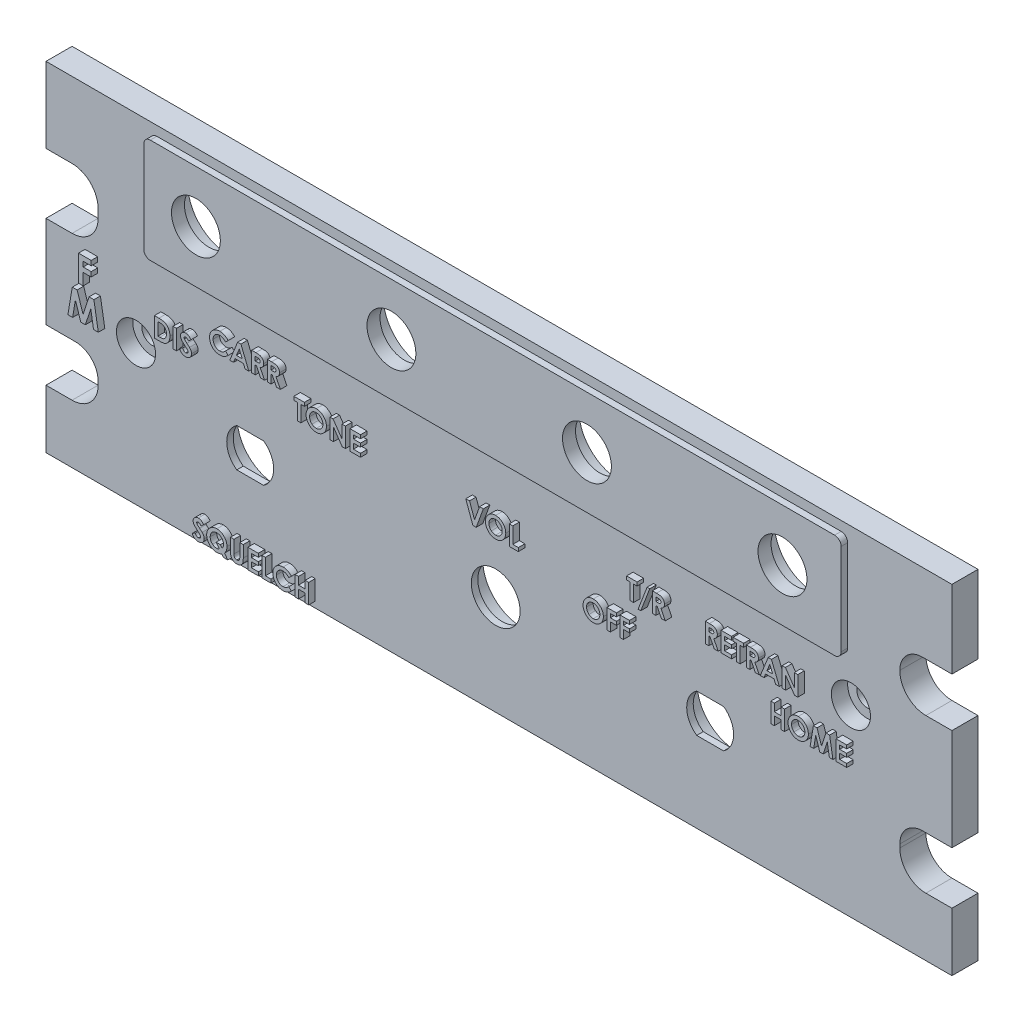
from build123d import *

# Parameters (mm, degrees)
SKETCH1_R            = 1.6
SKETCH1_R_2          = 3.75
EXTRUSION_BASE_DEPTH = 4
SKETCH5_R            = 3.75
BOSS_EXTRUDE1_DEPTH  = 1
SKETCH6_R            = 6.25
SKETCH6_R_2          = 6
BACK_HOLES_DEPTH     = 3
SKETCH7_R            = 3
CUT_EXTRUDE2_DEPTH   = 2.5
SKETCH4_W            = 0.538461538
SKETCH4_H            = 3
TEXTOS_DEPTH         = 1


with BuildPart() as part:
    # Sketch1 → Extrusion base (new body)
    with BuildSketch(Plane.XY):
        with BuildLine():
            Line((0, 0), (131, 0))
            Line((131, 0), (139, 0))
            Line((139, 0), (139, 8.970154863))
            Line((139, 8.970154863), (135, 8.970154863))
            ThreePointArc((135, 8.970154863), (132.171572875, 10.141727738), (131, 12.970154863))
            Line((131, 12.970154863), (131, 13.5))
            ThreePointArc((131, 13.5), (132.025126266, 15.974873734), (134.5, 17))
            Line((134.5, 17), (139, 17))
            Line((139, 17), (139, 32.574231754))
            Line((139, 32.574231754), (135, 32.574231754))
            ThreePointArc((135, 32.574231754), (132.171572875, 33.745804629), (131, 36.574231754))
            ThreePointArc((131, 36.574231754), (132.025126266, 39.049105488), (134.5, 40.074231754))
            Line((134.5, 40.074231754), (139, 40.074231754))
            Line((139, 40.074231754), (139, 52))
            Line((139, 52), (131, 52))
            Line((131, 52), (8, 52))
            Line((8, 52), (0, 52))
            Line((0, 52), (0, 40.424774177))
            Line((0, 40.424774177), (4, 40.424774177))
            ThreePointArc((4, 40.424774177), (6.828427125, 39.253201302), (8, 36.424774177))
            Line((8, 36.424774177), (8, 35.140702551))
            ThreePointArc((8, 35.140702551), (6.828427125, 32.312275426), (4, 31.140702551))
            Line((4, 31.140702551), (0, 31.140702551))
            Line((0, 31.140702551), (0, 17))
            Line((0, 17), (4.5, 17))
            ThreePointArc((4.5, 17), (6.974873734, 15.974873734), (8, 13.5))
            Line((8, 13.5), (8, 12.970154863))
            ThreePointArc((8, 12.970154863), (6.828427125, 10.141727738), (4, 8.970154863))
            Line((4, 8.970154863), (0, 8.970154863))
            Line((0, 8.970154863), (0, 0))
        make_face()
        with Locations((13.809088021, 21.5)):
            Circle(SKETCH1_R, mode=Mode.SUBTRACT)
        with Locations((69, 15.301613352)):
            Circle(SKETCH1_R_2, mode=Mode.SUBTRACT)
        with Locations((123.5, 28.19419762)):
            Circle(SKETCH1_R, mode=Mode.SUBTRACT)
        with Locations((114, 42.541519479)):
            Circle(SKETCH1_R_2, mode=Mode.SUBTRACT)
        with Locations((84, 42.541519479)):
            Circle(SKETCH1_R_2, mode=Mode.SUBTRACT)
        with Locations((54, 42.541519479)):
            Circle(SKETCH1_R_2, mode=Mode.SUBTRACT)
        with Locations((24, 42.541519479)):
            Circle(SKETCH1_R_2, mode=Mode.SUBTRACT)
        with BuildLine():
            Line((99.839676821, 12.351613352), (103.966418878, 12.351613352))
            ThreePointArc((103.966418878, 12.351613352), (105.503047849, 15.301613352), (103.966418878, 18.251613352))
            Line((103.966418878, 18.251613352), (99.839676821, 18.251613352))
            ThreePointArc((99.839676821, 18.251613352), (98.303047849, 15.301613352), (99.839676821, 12.351613352))
        make_face(mode=Mode.SUBTRACT)
        with BuildLine():
            Line((29.267863143, 12.351613352), (33.394605199, 12.351613352))
            ThreePointArc((33.394605199, 12.351613352), (34.931234171, 15.301613352), (33.394605199, 18.251613352))
            Line((33.394605199, 18.251613352), (29.267863143, 18.251613352))
            ThreePointArc((29.267863143, 18.251613352), (27.731234171, 15.301613352), (29.267863143, 12.351613352))
        make_face(mode=Mode.SUBTRACT)
    extrude(amount=EXTRUSION_BASE_DEPTH)

    # Sketch5 → Boss-Extrude1 (add)
    with BuildSketch(Plane.XY.offset(4)):
        with BuildLine():
            Line((122, 34.541519479), (17, 34.541519479))
            ThreePointArc((17, 34.541519479), (16.292893219, 34.834412698), (16, 35.541519479))
            Line((16, 35.541519479), (16, 49.541519479))
            ThreePointArc((16, 49.541519479), (16.292893219, 50.24862626), (17, 50.541519479))
            Line((17, 50.541519479), (122, 50.541519479))
            ThreePointArc((122, 50.541519479), (122.707106781, 50.24862626), (123, 49.541519479))
            Line((123, 49.541519479), (123, 35.541519479))
            ThreePointArc((123, 35.541519479), (122.707106781, 34.834412698), (122, 34.541519479))
        make_face()
        with Locations((114, 42.541519479)):
            Circle(SKETCH5_R, mode=Mode.SUBTRACT)
        with Locations((84, 42.541519479)):
            Circle(SKETCH5_R, mode=Mode.SUBTRACT)
        with Locations((54, 42.541519479)):
            Circle(SKETCH5_R, mode=Mode.SUBTRACT)
        with Locations((24, 42.541519479)):
            Circle(SKETCH5_R, mode=Mode.SUBTRACT)
    extrude(amount=BOSS_EXTRUDE1_DEPTH)

    # Sketch6 → Back Holes (cut)
    with BuildSketch(Plane(origin=(0, 0, 0), x_dir=(-1, 0, 0), z_dir=(0, 0, -1))):
        with Locations((-114, 42.541519479)):
            Circle(SKETCH6_R)
        with Locations((-84, 42.541519479)):
            Circle(SKETCH6_R)
        with Locations((-54, 42.541519479)):
            Circle(SKETCH6_R)
        with Locations((-24, 42.541519479)):
            Circle(SKETCH6_R)
        with Locations((-31.331234171, 15.301613352)):
            Circle(SKETCH6_R_2)
        with Locations((-69, 15.301613352)):
            Circle(SKETCH6_R_2)
        with Locations((-101.903047849, 15.301613352)):
            Circle(SKETCH6_R_2)
    extrude(amount=-BACK_HOLES_DEPTH, mode=Mode.SUBTRACT)

    # Sketch7 → Cut-Extrude2 (cut)
    with BuildSketch(Plane.XY.offset(4)):
        with Locations((13.809088021, 21.5)):
            Circle(SKETCH7_R)
        with Locations((123.5, 28.19419762)):
            Circle(SKETCH7_R)
    extrude(amount=-CUT_EXTRUDE2_DEPTH, mode=Mode.SUBTRACT)

    # Sketch4 → Textos (add)
    # profile 1 of 39: a face of its own
    with BuildSketch(Plane.XY.offset(4)):
        Polygon((5.980838855, 30.010447686), (7.929556804, 30.010447686), (7.929556804, 29.292498968), (6.698787573, 29.292498968), (6.698787573, 28.523268199), (7.929556804, 28.523268199), (7.929556804, 27.805319481), (6.698787573, 27.805319481), (6.698787573, 26.010447686), (5.980838855, 26.010447686), align=None)
    # profile 2 of 39: a face of its own
    with BuildSketch(Plane.XY.offset(4)):
        with BuildLine():
            Line((28.94423865, 29.867559595), (28.549406919, 29.490155749))
            add(Edge.make_bspline(
                [(28.549406919, 29.490155749), (28.515914075, 29.524787406), (28.450492058, 29.592433881), (28.345072568, 29.681991853), (28.235440137, 29.756626306), (28.123727444, 29.819482966), (28.007925103, 29.867038509), (27.889372104, 29.901693035), (27.767311451, 29.922820589), (27.684705496, 29.925237955), (27.643156919, 29.926453826)],
                knots=[0, 0, 0, 0, 1.115251505, 2.178435587, 3.19620269, 4.182487026, 5.141301733, 6.088180966, 7.038406374, 8, 8, 8, 8], degree=3))
            add(Edge.make_bspline(
                [(27.643156919, 29.926453826), (27.608458808, 29.925493246), (27.53998591, 29.923597647), (27.439449751, 29.909701038), (27.34328172, 29.88606925), (27.251152617, 29.853500269), (27.163333537, 29.811357736), (27.079640355, 29.759674268), (27.000279415, 29.698916641), (26.926299028, 29.629399217), (26.858624369, 29.553446208), (26.798829499, 29.472404528), (26.748741704, 29.386459839), (26.707635465, 29.296482527), (26.675615295, 29.202056131), (26.65274887, 29.103244224), (26.63952354, 28.999929127), (26.637549571, 28.929696294), (26.636546342, 28.894001903)],
                knots=[0, 0, 0, 0, 1.035432265, 2.043311493, 3.022114605, 3.98653278, 4.95457646, 5.923598177, 6.917315552, 7.932509744, 8.948865224, 9.949768934, 10.933144597, 11.912367597, 12.897413939, 13.903909035, 14.934704909, 16, 16, 16, 16], degree=3))
            add(Edge.make_bspline(
                [(26.636546342, 28.894001903), (26.636835461, 28.868949081), (26.637405321, 28.819569455), (26.643643445, 28.746523283), (26.653688296, 28.675651227), (26.668225683, 28.60706064), (26.686404829, 28.540692081), (26.707733107, 28.47597299), (26.734489117, 28.41379764), (26.764188692, 28.353443906), (26.798728956, 28.296558613), (26.835969732, 28.242313766), (26.876351274, 28.190975266), (26.920135134, 28.142752987), (26.967937517, 28.098400537), (27.018522908, 28.056584182), (27.072744612, 28.018350729), (27.129476307, 27.982740667), (27.189208083, 27.951805903), (27.250319278, 27.923784983), (27.313736462, 27.90102783), (27.378687492, 27.882683489), (27.444940257, 27.867084366), (27.513142769, 27.857479507), (27.582703798, 27.85020586), (27.629715378, 27.849756754), (27.653373265, 27.849530749)],
                knots=[0, 0, 0, 0, 1.103660481, 2.175337485, 3.227646561, 4.255952547, 5.262355991, 6.258840057, 7.255597736, 8.242457506, 9.22035537, 10.185017736, 11.140346927, 12.096287581, 13.051739095, 14.01125915, 14.986044842, 15.97314143, 16.960198552, 17.947847494, 18.933482797, 19.925264591, 20.920966487, 21.929612487, 22.958107872, 24, 24, 24, 24], degree=3))
            add(Edge.make_bspline(
                [(27.653373265, 27.849530749), (27.693501108, 27.850691459), (27.772341885, 27.852971953), (27.888052062, 27.87080509), (27.998312332, 27.900139592), (28.086409761, 27.934781934), (28.155431769, 27.968991697), (28.207977203, 28.000634043), (28.262313278, 28.036029481), (28.317537517, 28.076513873), (28.374271084, 28.121601391), (28.4315125, 28.172279534), (28.490727155, 28.226879546), (28.529518089, 28.265848646), (28.549406919, 28.285828826)],
                knots=[0, 0, 0, 0, 1.404581149, 2.759636711, 4.088442092, 5.392261763, 6.066678138, 6.783632037, 7.538459478, 8.336747902, 9.180226004, 10.074962426, 11.012997595, 12, 12, 12, 12], degree=3))
            Line((28.549406919, 28.285828826), (28.932219419, 27.883785556))
            add(Edge.make_bspline(
                [(28.932219419, 27.883785556), (28.905309761, 27.857805126), (28.852787863, 27.807096883), (28.773560038, 27.735095908), (28.694431924, 27.670395029), (28.617315092, 27.610645886), (28.540946287, 27.557589117), (28.465333609, 27.511171734), (28.391333026, 27.470219774), (28.317407892, 27.435423872), (28.243098207, 27.405878537), (28.166642273, 27.380441943), (28.087806359, 27.358923499), (28.006108969, 27.341560941), (27.922312127, 27.327638514), (27.835631607, 27.318240956), (27.746617006, 27.31192329), (27.686237022, 27.311355595), (27.655777111, 27.31106921)],
                knots=[0, 0, 0, 0, 1.244526981, 2.429050516, 3.560637417, 4.644440555, 5.67424972, 6.652764056, 7.595344123, 8.486817594, 9.369275933, 10.254498637, 11.166417451, 12.086725134, 13.032340136, 13.991389299, 14.986715468, 16, 16, 16, 16], degree=3))
            add(Edge.make_bspline(
                [(27.655777111, 27.31106921), (27.599826028, 27.312495515), (27.49034531, 27.315286397), (27.329904173, 27.335964942), (27.1774894, 27.370632158), (27.032730193, 27.419661163), (26.895672584, 27.48229342), (26.766351635, 27.559077625), (26.644975784, 27.649809776), (26.532525507, 27.753426404), (26.430808881, 27.867862271), (26.340903162, 27.990734997), (26.266533148, 28.122648458), (26.204782123, 28.26165387), (26.156493634, 28.408385568), (26.122506723, 28.563002272), (26.101547244, 28.72535469), (26.099254247, 28.836245134), (26.098084804, 28.89279998)],
                knots=[0, 0, 0, 0, 1.078019885, 2.10938526, 3.111377082, 4.085535484, 5.04941344, 6.010039228, 6.978205633, 7.964457913, 8.951525778, 9.924444315, 10.892603023, 11.863865945, 12.85144698, 13.863884204, 14.910567087, 16, 16, 16, 16], degree=3))
            add(Edge.make_bspline(
                [(26.098084804, 28.89279998), (26.098578954, 28.929684567), (26.099558238, 29.002780806), (26.10985061, 29.110457487), (26.124198776, 29.21542299), (26.146960835, 29.316587427), (26.174398252, 29.415313667), (26.208520286, 29.510528674), (26.249272437, 29.602506103), (26.29534117, 29.69139993), (26.347458266, 29.776627807), (26.405678783, 29.857457491), (26.4685039, 29.934512972), (26.537443199, 30.006771966), (26.611494904, 30.074868922), (26.69099335, 30.138434809), (26.775460392, 30.198381233), (26.865124652, 30.253162321), (26.958244192, 30.302714728), (27.05364453, 30.346422067), (27.151091277, 30.382951337), (27.250172421, 30.413251019), (27.351306578, 30.435867589), (27.453771878, 30.452987604), (27.558440178, 30.462557801), (27.628715873, 30.464124503), (27.664190573, 30.464915364)],
                knots=[0, 0, 0, 0, 1.071919942, 2.124283339, 3.142214191, 4.149696895, 5.136002878, 6.119640489, 7.086990633, 8.058538607, 9.028339693, 9.988281803, 10.952401235, 11.916291999, 12.888973767, 13.874849856, 14.873389453, 15.898127285, 16.927174885, 17.938320013, 18.946391617, 19.950418109, 20.947802303, 21.956882652, 22.968648068, 24, 24, 24, 24], degree=3))
            add(Edge.make_bspline(
                [(27.664190573, 30.464915364), (27.694454129, 30.464462023), (27.754666585, 30.463560054), (27.844333035, 30.456041162), (27.933282376, 30.444232819), (28.02119614, 30.426416543), (28.108703177, 30.405266372), (28.194653546, 30.377573141), (28.280403161, 30.346703816), (28.364607167, 30.309805841), (28.4473831, 30.269528368), (28.526791803, 30.223832113), (28.604166541, 30.175529171), (28.677792737, 30.121760764), (28.749049567, 30.06447717), (28.817564424, 30.003411131), (28.882736049, 29.937544496), (28.923634143, 29.891005829), (28.94423865, 29.867559595)],
                knots=[0, 0, 0, 0, 0.996412454, 1.982464992, 2.961075852, 3.949442424, 4.934965278, 5.923860011, 6.921385422, 7.934793307, 8.949617135, 9.951082467, 10.950285876, 11.951772932, 12.951063433, 13.960125323, 14.972308753, 16, 16, 16, 16], degree=3))
        make_face()
    # profile 3 of 39: a face of its own
    with BuildSketch(Plane.XY.offset(4)):
        Polygon((30.40517615, 30.387992287), (30.905777111, 30.387992287), (32.117315573, 27.387992287), (31.542195381, 27.387992287), (31.309022304, 28.003376903), (30.003132881, 28.003376903), (29.769358842, 27.387992287), (29.19423865, 27.387992287), align=None)
        Polygon((30.655777111, 29.583304787), (30.207459804, 28.541838441), (31.104695381, 28.541838441), align=None, mode=Mode.SUBTRACT)
    # profile 4 of 39: a face of its own
    with BuildSketch(Plane.XY.offset(4)):
        with BuildLine():
            Line((32.559623265, 30.387992287), (33.187027111, 30.387992287))
            add(Edge.make_bspline(
                [(33.187027111, 30.387992287), (33.228498315, 30.387845088), (33.30825912, 30.387561983), (33.423269846, 30.383095335), (33.528923013, 30.376879627), (33.625375053, 30.367394292), (33.7125847, 30.354817884), (33.790639359, 30.339992381), (33.859536749, 30.323095541), (33.919857924, 30.302040746), (33.974294802, 30.278291256), (34.02503754, 30.251002656), (34.073205599, 30.220478814), (34.118477027, 30.185916565), (34.161245244, 30.147937675), (34.201590934, 30.106503915), (34.238943976, 30.061263943), (34.273073077, 30.012503619), (34.304179006, 29.961208876), (34.331670123, 29.907309286), (34.354025946, 29.850767366), (34.373779711, 29.792400269), (34.388007708, 29.731373625), (34.397903072, 29.66828154), (34.405148071, 29.602901922), (34.405564623, 29.558485912), (34.405777111, 29.535828826)],
                knots=[0, 0, 0, 0, 1.749336639, 3.364467119, 4.854658419, 6.213483162, 7.451590619, 8.570285859, 9.5643256, 10.440900261, 11.26203566, 12.067320669, 12.869050712, 13.665104639, 14.467235401, 15.27997916, 16.102287765, 16.939272006, 17.78853747, 18.631303466, 19.488103222, 20.351255419, 21.228522269, 22.127379805, 23.044756219, 24, 24, 24, 24], degree=3))
            add(Edge.make_bspline(
                [(34.405777111, 29.535828826), (34.405225144, 29.512180033), (34.404142836, 29.46580906), (34.398312937, 29.397693882), (34.387657714, 29.332526045), (34.371518828, 29.270496351), (34.352969274, 29.210832769), (34.328303126, 29.154636129), (34.300464941, 29.101089133), (34.267402341, 29.050949222), (34.231117753, 29.003102689), (34.18891954, 28.959382713), (34.143541498, 28.917439511), (34.092432764, 28.879900261), (34.037846256, 28.844226697), (33.978697398, 28.811896947), (33.915372217, 28.782098317), (33.870851478, 28.765480542), (33.848084804, 28.756982672)],
                knots=[0, 0, 0, 0, 1.099860209, 2.156625411, 3.176576793, 4.16617041, 5.135385252, 6.078461593, 7.016046972, 7.938469504, 8.868247731, 9.803980173, 10.76021508, 11.73834243, 12.748633912, 13.790971185, 14.870363756, 16, 16, 16, 16], degree=3))
            Line((33.848084804, 28.756982672), (34.540392496, 27.387992287))
            Line((34.540392496, 27.387992287), (33.941834804, 27.387992287))
            Line((33.941834804, 27.387992287), (33.280777111, 28.695684595))
            Line((33.280777111, 28.695684595), (33.098084804, 28.695684595))
            Line((33.098084804, 28.695684595), (33.098084804, 27.387992287))
            Line((33.098084804, 27.387992287), (32.559623265, 27.387992287))
            Line((32.559623265, 27.387992287), (32.559623265, 30.387992287))
        make_face()
        with BuildLine():
            Line((33.098084804, 29.234146133), (33.307820381, 29.234146133))
            add(Edge.make_bspline(
                [(33.307820381, 29.234146133), (33.333462298, 29.23443493), (33.382561061, 29.234987913), (33.45317153, 29.237552879), (33.517302676, 29.243733178), (33.5752299, 29.251541756), (33.627244685, 29.260557887), (33.672883078, 29.273478549), (33.712848297, 29.287323366), (33.746666754, 29.304528882), (33.775560466, 29.324095285), (33.800508337, 29.346323206), (33.821143804, 29.372049194), (33.838127845, 29.400574128), (33.851339583, 29.432150303), (33.86098314, 29.466431086), (33.866372461, 29.503806977), (33.866992521, 29.529601432), (33.867315573, 29.543040364)],
                knots=[0, 0, 0, 0, 1.688639943, 3.233382647, 4.650958383, 5.928841754, 7.082724185, 8.122798841, 9.049171256, 9.863274652, 10.613301712, 11.341792392, 12.054588806, 12.776240173, 13.521029143, 14.301969904, 15.115324896, 16, 16, 16, 16], degree=3))
            add(Edge.make_bspline(
                [(33.867315573, 29.543040364), (33.866704814, 29.558939602), (33.865505092, 29.590170709), (33.853600117, 29.635132552), (33.834649968, 29.676747814), (33.808674505, 29.714828467), (33.775961786, 29.748212596), (33.738421359, 29.777640972), (33.695243013, 29.800910729), (33.655263114, 29.816259214), (33.618890751, 29.82544237), (33.58606584, 29.832285577), (33.548054396, 29.837135554), (33.504827722, 29.842279818), (33.456496005, 29.845615613), (33.402795806, 29.848050079), (33.343881354, 29.849046138), (33.302812385, 29.849364561), (33.281378073, 29.849530749)],
                knots=[0, 0, 0, 0, 1.020303359, 2.004196876, 2.966617323, 3.9489082, 4.950758222, 5.960522915, 7.003732012, 8.091992268, 8.70421221, 9.413913587, 10.24622431, 11.166358409, 12.212345909, 13.359657661, 14.621978493, 16, 16, 16, 16], degree=3))
            Line((33.281378073, 29.849530749), (33.098084804, 29.849530749))
            Line((33.098084804, 29.849530749), (33.098084804, 29.234146133))
        make_face(mode=Mode.SUBTRACT)
    # profile 5 of 39: a face of its own
    with BuildSketch(Plane.XY.offset(4)):
        with BuildLine():
            Line((34.982700188, 30.387992287), (35.610104035, 30.387992287))
            add(Edge.make_bspline(
                [(35.610104035, 30.387992287), (35.651575238, 30.387845088), (35.731336043, 30.387561983), (35.846346769, 30.383095335), (35.951999937, 30.376879627), (36.048451976, 30.367394292), (36.135661623, 30.354817884), (36.213716282, 30.339992381), (36.282613672, 30.323095541), (36.342934847, 30.302040746), (36.397371725, 30.278291256), (36.448114463, 30.251002656), (36.496282522, 30.220478814), (36.54155395, 30.185916565), (36.584322167, 30.147937675), (36.624667857, 30.106503915), (36.662020899, 30.061263943), (36.69615, 30.012503619), (36.727255929, 29.961208876), (36.754747047, 29.907309286), (36.777102869, 29.850767366), (36.796856634, 29.792400269), (36.811084631, 29.731373625), (36.820979995, 29.66828154), (36.828224994, 29.602901922), (36.828641546, 29.558485912), (36.828854035, 29.535828826)],
                knots=[0, 0, 0, 0, 1.749336639, 3.364467119, 4.854658419, 6.213483162, 7.451590619, 8.570285859, 9.5643256, 10.440900261, 11.26203566, 12.067320669, 12.869050712, 13.665104639, 14.467235401, 15.27997916, 16.102287765, 16.939272006, 17.78853747, 18.631303466, 19.488103222, 20.351255419, 21.228522269, 22.127379805, 23.044756219, 24, 24, 24, 24], degree=3))
            add(Edge.make_bspline(
                [(36.828854035, 29.535828826), (36.828302067, 29.512180033), (36.827219759, 29.46580906), (36.82138986, 29.397693882), (36.810734637, 29.332526045), (36.794595751, 29.270496351), (36.776046197, 29.210832769), (36.751380049, 29.154636129), (36.723541864, 29.101089133), (36.690479264, 29.050949222), (36.654194676, 29.003102689), (36.611996463, 28.959382713), (36.566618421, 28.917439511), (36.515509687, 28.879900261), (36.460923179, 28.844226697), (36.401774321, 28.811896947), (36.33844914, 28.782098317), (36.293928401, 28.765480542), (36.271161727, 28.756982672)],
                knots=[0, 0, 0, 0, 1.099860209, 2.156625411, 3.176576793, 4.16617041, 5.135385252, 6.078461593, 7.016046972, 7.938469504, 8.868247731, 9.803980173, 10.76021508, 11.73834243, 12.748633912, 13.790971185, 14.870363756, 16, 16, 16, 16], degree=3))
            Line((36.271161727, 28.756982672), (36.963469419, 27.387992287))
            Line((36.963469419, 27.387992287), (36.364911727, 27.387992287))
            Line((36.364911727, 27.387992287), (35.703854035, 28.695684595))
            Line((35.703854035, 28.695684595), (35.521161727, 28.695684595))
            Line((35.521161727, 28.695684595), (35.521161727, 27.387992287))
            Line((35.521161727, 27.387992287), (34.982700188, 27.387992287))
            Line((34.982700188, 27.387992287), (34.982700188, 30.387992287))
        make_face()
        with BuildLine():
            Line((35.521161727, 29.234146133), (35.730897304, 29.234146133))
            add(Edge.make_bspline(
                [(35.730897304, 29.234146133), (35.756539221, 29.23443493), (35.805637984, 29.234987913), (35.876248454, 29.237552879), (35.940379599, 29.243733178), (35.998306823, 29.251541756), (36.050321608, 29.260557887), (36.095960001, 29.273478549), (36.135925221, 29.287323366), (36.169743677, 29.304528882), (36.198637389, 29.324095285), (36.22358526, 29.346323206), (36.244220727, 29.372049194), (36.261204768, 29.400574128), (36.274416506, 29.432150303), (36.284060063, 29.466431086), (36.289449385, 29.503806977), (36.290069444, 29.529601432), (36.290392496, 29.543040364)],
                knots=[0, 0, 0, 0, 1.688639943, 3.233382647, 4.650958383, 5.928841754, 7.082724185, 8.122798841, 9.049171256, 9.863274652, 10.613301712, 11.341792392, 12.054588806, 12.776240173, 13.521029143, 14.301969904, 15.115324896, 16, 16, 16, 16], degree=3))
            add(Edge.make_bspline(
                [(36.290392496, 29.543040364), (36.289781737, 29.558939602), (36.288582015, 29.590170709), (36.27667704, 29.635132552), (36.257726891, 29.676747814), (36.231751428, 29.714828467), (36.199038709, 29.748212596), (36.161498283, 29.777640972), (36.118319936, 29.800910729), (36.078340037, 29.816259214), (36.041967674, 29.82544237), (36.009142763, 29.832285577), (35.971131319, 29.837135554), (35.927904645, 29.842279818), (35.879572928, 29.845615613), (35.825872729, 29.848050079), (35.766958277, 29.849046138), (35.725889308, 29.849364561), (35.704454996, 29.849530749)],
                knots=[0, 0, 0, 0, 1.020303359, 2.004196876, 2.966617323, 3.9489082, 4.950758222, 5.960522915, 7.003732012, 8.091992268, 8.70421221, 9.413913587, 10.24622431, 11.166358409, 12.212345909, 13.359657661, 14.621978493, 16, 16, 16, 16], degree=3))
            Line((35.704454996, 29.849530749), (35.521161727, 29.849530749))
            Line((35.521161727, 29.849530749), (35.521161727, 29.234146133))
        make_face(mode=Mode.SUBTRACT)
    # profile 6 of 39: a face of its own
    with BuildSketch(Plane.XY.offset(4)):
        Polygon((39.022699607, 27.509831768), (40.638084223, 27.509831768), (40.638084223, 26.971370229), (40.099622684, 26.971370229), (40.099622684, 24.509831768), (39.561161146, 24.509831768), (39.561161146, 26.971370229), (39.022699607, 26.971370229), align=None)
    # profile 7 of 39: a face of its own
    with BuildSketch(Plane.XY.offset(4)):
        with BuildLine():
            add(Edge.make_bspline(
                [(42.471016915, 27.586754845), (42.523175592, 27.585404363), (42.626148633, 27.582738207), (42.777584818, 27.560513712), (42.923521583, 27.524302084), (43.063892935, 27.473965301), (43.198347401, 27.408139989), (43.327359246, 27.328692338), (43.450466357, 27.23412282), (43.566407231, 27.126637587), (43.673557508, 27.00975209), (43.766403286, 26.883904072), (43.84557876, 26.752354381), (43.911199604, 26.614750526), (43.961182091, 26.470139535), (43.996256869, 26.319258733), (44.018790676, 26.162151044), (44.021382411, 26.055182122), (44.022699607, 26.000817345)],
                knots=[0, 0, 0, 0, 1.014329547, 2.002516266, 2.970391464, 3.935626869, 4.897733899, 5.877609409, 6.878433252, 7.912639331, 8.949961323, 9.958554974, 10.949718813, 11.932905612, 12.9188844, 13.919928257, 14.942845884, 16, 16, 16, 16], degree=3))
            add(Edge.make_bspline(
                [(44.022699607, 26.000817345), (44.02129685, 25.947065133), (44.018532672, 25.841144676), (43.997176798, 25.685484796), (43.961511356, 25.536220241), (43.912376611, 25.393013149), (43.847945881, 25.256557164), (43.770314415, 25.125981035), (43.677433668, 25.002496539), (43.572691364, 24.886169942), (43.457379177, 24.780578595), (43.335245266, 24.687526402), (43.206853569, 24.608677486), (43.072392011, 24.544067962), (42.931572246, 24.49392689), (42.784742114, 24.458548721), (42.631910704, 24.437048693), (42.527977933, 24.43430257), (42.475223646, 24.432908691)],
                knots=[0, 0, 0, 0, 1.051557043, 2.072126891, 3.067553643, 4.050577992, 5.02905126, 6.015227836, 7.017913613, 8.04756643, 9.074058332, 10.072836633, 11.047628519, 12.017157415, 12.98668631, 13.966869689, 14.968021931, 16, 16, 16, 16], degree=3))
            add(Edge.make_bspline(
                [(42.475223646, 24.432908691), (42.420048987, 24.434159069), (42.311638324, 24.436615892), (42.152978834, 24.459979154), (42.000969333, 24.495172389), (41.856886788, 24.547696403), (41.719263843, 24.613355837), (41.589111652, 24.694219368), (41.466473957, 24.79015336), (41.352054226, 24.89870091), (41.248389673, 25.017475737), (41.156885372, 25.14295081), (41.079699463, 25.274167608), (41.016829124, 25.411187544), (40.967264674, 25.553159073), (40.932302586, 25.700946841), (40.911649647, 25.854196401), (40.908772812, 25.958286565), (40.907314992, 26.011033691)],
                knots=[0, 0, 0, 0, 1.067978421, 2.098431617, 3.099715153, 4.085208694, 5.062210972, 6.048429807, 7.046490867, 8.072918869, 9.098532598, 10.095778865, 11.076610158, 12.041847152, 13.011192615, 13.984257998, 14.978533688, 16, 16, 16, 16], degree=3))
            add(Edge.make_bspline(
                [(40.907314992, 26.011033691), (40.90777254, 26.046519196), (40.908681842, 26.117040877), (40.919635347, 26.221550409), (40.935405245, 26.324020056), (40.958728176, 26.424041269), (40.987059575, 26.522319651), (41.023766906, 26.617940403), (41.065549782, 26.711925018), (41.114369138, 26.803163419), (41.168651542, 26.890816137), (41.227878477, 26.974469699), (41.29219887, 27.053112611), (41.361405522, 27.127261681), (41.43573693, 27.196429523), (41.514215339, 27.261595304), (41.598362776, 27.321027989), (41.686337515, 27.376179042), (41.777643576, 27.426051183), (41.871909261, 27.468500858), (41.967192509, 27.505571436), (42.064766177, 27.534829175), (42.163584589, 27.558659298), (42.264703421, 27.574418567), (42.367209119, 27.585371768), (42.436332198, 27.586292725), (42.471016915, 27.586754845)],
                knots=[0, 0, 0, 0, 1.034744296, 2.056386356, 3.06226378, 4.057406941, 5.050368692, 6.043467995, 7.042652155, 8.049140477, 9.059438543, 10.048523776, 11.036952808, 12.020949711, 13.004946614, 13.997082645, 14.994316842, 16.007702937, 17.024872941, 18.026463647, 19.021641123, 20.005082605, 20.995858141, 21.984425357, 22.988620895, 24, 24, 24, 24], degree=3))
        make_face()
        with BuildLine():
            add(Edge.make_bspline(
                [(42.462603453, 27.048293306), (42.427500671, 27.04735142), (42.358221825, 27.045492513), (42.256602375, 27.031330156), (42.159044114, 27.008711262), (42.066087847, 26.975948071), (41.977330692, 26.934248843), (41.892615311, 26.883759282), (41.813114837, 26.822743865), (41.737769208, 26.754478238), (41.66970683, 26.678414641), (41.609571572, 26.596899561), (41.559248047, 26.510069126), (41.51710178, 26.418729971), (41.485374981, 26.321855012), (41.462776934, 26.22020308), (41.448495812, 26.113599023), (41.446695658, 26.040927177), (41.44577653, 26.003822152)],
                knots=[0, 0, 0, 0, 1.033739768, 2.040188636, 3.016340934, 3.979330865, 4.937572243, 5.900995986, 6.878200029, 7.884839167, 8.891893314, 9.879764717, 10.863503415, 11.843163062, 12.837761627, 13.859916423, 14.907309254, 16, 16, 16, 16], degree=3))
            add(Edge.make_bspline(
                [(41.44577653, 26.003822152), (41.446995154, 25.962701438), (41.449383454, 25.882111652), (41.466187823, 25.764549443), (41.494938426, 25.653523605), (41.536453737, 25.549577149), (41.587943615, 25.451555826), (41.651885872, 25.360661028), (41.727244945, 25.276348518), (41.785300965, 25.227123363), (41.814766915, 25.20213946)],
                knots=[0, 0, 0, 0, 1.078454662, 2.113592447, 3.107694534, 4.079536787, 5.043276885, 6.005368276, 6.987637804, 8, 8, 8, 8], degree=3))
            add(Edge.make_bspline(
                [(41.814766915, 25.20213946), (41.838905154, 25.183682312), (41.886637793, 25.147183858), (41.962829476, 25.100403603), (42.041291908, 25.060308257), (42.122617184, 25.027911692), (42.206633551, 25.002429099), (42.293329487, 24.984584057), (42.382582151, 24.973384751), (42.442938986, 24.972046221), (42.473420761, 24.971370229)],
                knots=[0, 0, 0, 0, 1.023928204, 2.024787132, 3.009472467, 3.9914905, 4.972207045, 5.96565515, 6.972602802, 8, 8, 8, 8], degree=3))
            add(Edge.make_bspline(
                [(42.473420761, 24.971370229), (42.50791995, 24.972320102), (42.57579819, 24.974189006), (42.675525939, 24.988177017), (42.771068152, 25.011849781), (42.863017962, 25.044325562), (42.951110228, 25.086548359), (43.034914418, 25.138603948), (43.114577465, 25.199853153), (43.189827105, 25.269015257), (43.258608833, 25.345378492), (43.318618601, 25.427328366), (43.370542163, 25.513059276), (43.411811998, 25.603784615), (43.444792251, 25.698647977), (43.467118319, 25.798069493), (43.481520084, 25.901639307), (43.483320744, 25.972122227), (43.484238069, 26.008028883)],
                knots=[0, 0, 0, 0, 1.026359118, 2.019393844, 2.989460624, 3.950973911, 4.916101784, 5.890408035, 6.881132271, 7.902007068, 8.92769091, 9.933912415, 10.920395702, 11.90457117, 12.894218921, 13.903490204, 14.931958862, 16, 16, 16, 16], degree=3))
            add(Edge.make_bspline(
                [(43.484238069, 26.008028883), (43.483289005, 26.043729066), (43.481420917, 26.113999433), (43.467408287, 26.21730297), (43.443885649, 26.316285569), (43.411312347, 26.411108877), (43.369717965, 26.501865857), (43.318282291, 26.588237354), (43.257185808, 26.670139867), (43.187834647, 26.747015262), (43.112350171, 26.817658826), (43.031310044, 26.878964598), (42.946981859, 26.932237365), (42.857430716, 26.973969099), (42.764488757, 27.007216683), (42.667588845, 27.031700681), (42.566363966, 27.045393021), (42.497498588, 27.047317927), (42.462603453, 27.048293306)],
                knots=[0, 0, 0, 0, 1.055025985, 2.07665775, 3.074803781, 4.057872707, 5.035505728, 6.020516407, 7.023567878, 8.050795229, 9.077271434, 10.074415901, 11.050397877, 12.019801805, 12.988065821, 13.964604439, 14.968634123, 16, 16, 16, 16], degree=3))
        make_face(mode=Mode.SUBTRACT)
    # profile 8 of 39: a face of its own
    with BuildSketch(Plane.XY.offset(4)):
        Polygon((44.561161146, 27.509831768), (45.046137107, 27.509831768), (46.407314992, 25.535673114), (46.407314992, 27.509831768), (46.94577653, 27.509831768), (46.94577653, 24.509831768), (46.4571948, 24.509831768), (45.099622684, 26.477980806), (45.099622684, 24.509831768), (44.561161146, 24.509831768), align=None)
    # profile 9 of 39: a face of its own
    with BuildSketch(Plane.XY.offset(4)):
        Polygon((47.638084223, 27.509831768), (49.253468838, 27.509831768), (49.253468838, 26.971370229), (48.176545761, 26.971370229), (48.176545761, 26.394447152), (49.253468838, 26.394447152), (49.253468838, 25.855985614), (48.176545761, 25.855985614), (48.176545761, 25.048293306), (49.253468838, 25.048293306), (49.253468838, 24.509831768), (47.638084223, 24.509831768), align=None)
    # profile 10 of 39: a face of its own
    with BuildSketch(Plane.XY.offset(4)):
        with BuildLine():
            add(Edge.make_bspline(
                [(84.96613233, 23.547123404), (85.018291007, 23.545772922), (85.121264048, 23.543106766), (85.272700233, 23.520882271), (85.418636998, 23.484670643), (85.55900835, 23.43433386), (85.693462816, 23.368508548), (85.822474662, 23.289060897), (85.945581773, 23.194491379), (86.061522646, 23.087006146), (86.168672923, 22.970120649), (86.261518701, 22.844272631), (86.340694175, 22.71272294), (86.406315019, 22.575119085), (86.456297506, 22.430508094), (86.491372284, 22.279627292), (86.513906092, 22.122519603), (86.516497826, 22.015550681), (86.517815022, 21.961185904)],
                knots=[0, 0, 0, 0, 1.014329547, 2.002516266, 2.970391464, 3.935626869, 4.897733899, 5.877609409, 6.878433252, 7.912639331, 8.949961323, 9.958554974, 10.949718813, 11.932905612, 12.9188844, 13.919928257, 14.942845884, 16, 16, 16, 16], degree=3))
            add(Edge.make_bspline(
                [(86.517815022, 21.961185904), (86.516412265, 21.907433692), (86.513648087, 21.801513235), (86.492292213, 21.645853355), (86.456626771, 21.4965888), (86.407492026, 21.353381708), (86.343061296, 21.216925723), (86.265429831, 21.086349594), (86.172549083, 20.962865098), (86.067806779, 20.846538501), (85.952494593, 20.740947154), (85.830360681, 20.647894961), (85.701968984, 20.569046045), (85.567507426, 20.504436521), (85.426687661, 20.454295449), (85.27985753, 20.41891728), (85.127026119, 20.397417252), (85.023093348, 20.394671129), (84.970339061, 20.39327725)],
                knots=[0, 0, 0, 0, 1.051557043, 2.072126891, 3.067553643, 4.050577992, 5.02905126, 6.015227836, 7.017913613, 8.04756643, 9.074058332, 10.072836633, 11.047628519, 12.017157415, 12.98668631, 13.966869689, 14.968021931, 16, 16, 16, 16], degree=3))
            add(Edge.make_bspline(
                [(84.970339061, 20.39327725), (84.915164402, 20.394527628), (84.806753739, 20.396984451), (84.648094249, 20.420347713), (84.496084748, 20.455540948), (84.352002203, 20.508064962), (84.214379258, 20.573724396), (84.084227067, 20.654587927), (83.961589372, 20.750521919), (83.847169642, 20.859069469), (83.743505089, 20.977844296), (83.652000787, 21.103319369), (83.574814878, 21.234536167), (83.511944539, 21.371556103), (83.462380089, 21.513527632), (83.427418001, 21.6613154), (83.406765062, 21.81456496), (83.403888227, 21.918655124), (83.402430407, 21.97140225)],
                knots=[0, 0, 0, 0, 1.067978421, 2.098431617, 3.099715153, 4.085208694, 5.062210972, 6.048429807, 7.046490867, 8.072918869, 9.098532598, 10.095778865, 11.076610158, 12.041847152, 13.011192615, 13.984257998, 14.978533688, 16, 16, 16, 16], degree=3))
            add(Edge.make_bspline(
                [(83.402430407, 21.97140225), (83.402887955, 22.006887754), (83.403797257, 22.077409436), (83.414750762, 22.181918968), (83.43052066, 22.284388615), (83.453843591, 22.384409828), (83.48217499, 22.48268821), (83.518882321, 22.578308962), (83.560665197, 22.672293577), (83.609484553, 22.763531978), (83.663766957, 22.851184696), (83.722993893, 22.934838258), (83.787314285, 23.01348117), (83.856520937, 23.08763024), (83.930852345, 23.156798082), (84.009330754, 23.221963863), (84.093478191, 23.281396548), (84.18145293, 23.336547601), (84.272758991, 23.386419742), (84.367024676, 23.428869417), (84.462307924, 23.465939995), (84.559881592, 23.495197734), (84.658700005, 23.519027857), (84.759818836, 23.534787126), (84.862324535, 23.545740327), (84.931447613, 23.546661284), (84.96613233, 23.547123404)],
                knots=[0, 0, 0, 0, 1.034744296, 2.056386356, 3.06226378, 4.057406941, 5.050368692, 6.043467995, 7.042652155, 8.049140477, 9.059438543, 10.048523776, 11.036952808, 12.020949711, 13.004946614, 13.997082645, 14.994316842, 16.007702937, 17.024872941, 18.026463647, 19.021641123, 20.005082605, 20.995858141, 21.984425357, 22.988620895, 24, 24, 24, 24], degree=3))
        make_face()
        with BuildLine():
            add(Edge.make_bspline(
                [(84.957718869, 23.008661865), (84.922616086, 23.007719979), (84.85333724, 23.005861072), (84.75171779, 22.991698715), (84.65415953, 22.969079821), (84.561203262, 22.936316629), (84.472446107, 22.894617402), (84.387730727, 22.844127841), (84.308230253, 22.783112424), (84.232884623, 22.714846797), (84.164822245, 22.6387832), (84.104686987, 22.55726812), (84.054363462, 22.470437685), (84.012217195, 22.37909853), (83.980490396, 22.282223571), (83.957892349, 22.180571639), (83.943611227, 22.073967582), (83.941811074, 22.001295736), (83.940891945, 21.964190711)],
                knots=[0, 0, 0, 0, 1.033739768, 2.040188636, 3.016340934, 3.979330865, 4.937572243, 5.900995986, 6.878200029, 7.884839167, 8.891893314, 9.879764717, 10.863503415, 11.843163062, 12.837761627, 13.859916423, 14.907309254, 16, 16, 16, 16], degree=3))
            add(Edge.make_bspline(
                [(83.940891945, 21.964190711), (83.942110569, 21.923069997), (83.944498869, 21.842480211), (83.961303238, 21.724918002), (83.990053841, 21.613892164), (84.031569153, 21.509945708), (84.083059031, 21.411924385), (84.147001287, 21.321029586), (84.22236036, 21.236717077), (84.28041638, 21.187491922), (84.30988233, 21.162508019)],
                knots=[0, 0, 0, 0, 1.078454662, 2.113592447, 3.107694534, 4.079536787, 5.043276885, 6.005368276, 6.987637804, 8, 8, 8, 8], degree=3))
            add(Edge.make_bspline(
                [(84.30988233, 21.162508019), (84.334020569, 21.144050871), (84.381753208, 21.107552417), (84.457944892, 21.060772162), (84.536407323, 21.020676816), (84.6177326, 20.988280251), (84.701748966, 20.962797658), (84.788444902, 20.944952616), (84.877697567, 20.93375331), (84.938054401, 20.93241478), (84.968536176, 20.931738788)],
                knots=[0, 0, 0, 0, 1.023928204, 2.024787132, 3.009472467, 3.9914905, 4.972207045, 5.96565515, 6.972602802, 8, 8, 8, 8], degree=3))
            add(Edge.make_bspline(
                [(84.968536176, 20.931738788), (85.003035366, 20.932688661), (85.070913606, 20.934557565), (85.170641355, 20.948545576), (85.266183567, 20.97221834), (85.358133377, 21.004694121), (85.446225643, 21.046916918), (85.530029834, 21.098972507), (85.60969288, 21.160221712), (85.68494252, 21.229383816), (85.753724248, 21.305747051), (85.813734016, 21.387696925), (85.865657578, 21.473427835), (85.906927413, 21.564153174), (85.939907666, 21.659016536), (85.962233734, 21.758438052), (85.976635499, 21.862007866), (85.97843616, 21.932490786), (85.979353484, 21.968397442)],
                knots=[0, 0, 0, 0, 1.026359118, 2.019393844, 2.989460624, 3.950973911, 4.916101784, 5.890408035, 6.881132271, 7.902007068, 8.92769091, 9.933912415, 10.920395702, 11.90457117, 12.894218921, 13.903490204, 14.931958862, 16, 16, 16, 16], degree=3))
            add(Edge.make_bspline(
                [(85.979353484, 21.968397442), (85.97840442, 22.004097625), (85.976536333, 22.074367992), (85.962523702, 22.177671529), (85.939001065, 22.276654128), (85.906427762, 22.371477436), (85.86483338, 22.462234416), (85.813397707, 22.548605912), (85.752301224, 22.630508426), (85.682950063, 22.707383821), (85.607465586, 22.778027385), (85.526425459, 22.839333157), (85.442097274, 22.892605924), (85.352546131, 22.934337658), (85.259604172, 22.967585242), (85.16270426, 22.99206924), (85.061479381, 23.00576158), (84.992614003, 23.007686486), (84.957718869, 23.008661865)],
                knots=[0, 0, 0, 0, 1.055025985, 2.07665775, 3.074803781, 4.057872707, 5.035505728, 6.020516407, 7.023567878, 8.050795229, 9.077271434, 10.074415901, 11.050397877, 12.019801805, 12.988065821, 13.964604439, 14.968634123, 16, 16, 16, 16], degree=3))
        make_face(mode=Mode.SUBTRACT)
    # profile 11 of 39: a face of its own
    with BuildSketch(Plane.XY.offset(4)):
        Polygon((87.056276561, 23.470200327), (88.517815022, 23.470200327), (88.517815022, 22.931738788), (87.594738099, 22.931738788), (87.594738099, 22.354815711), (88.517815022, 22.354815711), (88.517815022, 21.816354173), (87.594738099, 21.816354173), (87.594738099, 20.470200327), (87.056276561, 20.470200327), align=None)
    # profile 12 of 39: a face of its own
    with BuildSketch(Plane.XY.offset(4)):
        Polygon((89.056276561, 23.470200327), (90.517815022, 23.470200327), (90.517815022, 22.931738788), (89.594738099, 22.931738788), (89.594738099, 22.354815711), (90.517815022, 22.354815711), (90.517815022, 21.816354173), (89.594738099, 21.816354173), (89.594738099, 20.470200327), (89.056276561, 20.470200327), align=None)
    # profile 13 of 39: a face of its own
    with BuildSketch(Plane.XY.offset(4)):
        with BuildLine():
            Line((17.635855326, 27.533390159), (18.314340903, 27.533390159))
            add(Edge.make_bspline(
                [(18.314340903, 27.533390159), (18.367236657, 27.533020399), (18.469484749, 27.53230565), (18.617622006, 27.524252146), (18.755370804, 27.511866429), (18.882819939, 27.494827629), (18.99970812, 27.472280632), (19.105884621, 27.443999843), (19.201705796, 27.411354377), (19.288222305, 27.372940362), (19.367203556, 27.328153435), (19.442198775, 27.278264395), (19.51306071, 27.221445659), (19.580783796, 27.158793374), (19.644494053, 27.089161337), (19.705252485, 27.013702905), (19.761571448, 26.931323828), (19.815153345, 26.843999295), (19.863611041, 26.751359235), (19.905877654, 26.65419218), (19.941284652, 26.553123435), (19.970054671, 26.448045289), (19.992987697, 26.339306568), (20.009033473, 26.226687848), (20.018953132, 26.110293395), (20.019959398, 26.031407159), (20.02047071, 25.991322851)],
                knots=[0, 0, 0, 0, 1.44355588, 2.790409838, 4.047694926, 5.217575253, 6.298404546, 7.294384826, 8.214239204, 9.058592145, 9.873746385, 10.689560431, 11.514393297, 12.350027578, 13.205127629, 14.088021785, 14.991911688, 15.926770944, 16.882954281, 17.842803888, 18.816321264, 19.80318086, 20.814351908, 21.847355356, 22.906180909, 24, 24, 24, 24], degree=3))
            add(Edge.make_bspline(
                [(20.02047071, 25.991322851), (20.019131819, 25.934761284), (20.016496133, 25.823416527), (19.994294587, 25.660019379), (19.95838717, 25.503386916), (19.90789808, 25.354744378), (19.845305124, 25.215415448), (19.770530829, 25.087857133), (19.684671561, 24.972754102), (19.588727584, 24.870679474), (19.484843625, 24.782944948), (19.376887242, 24.707806747), (19.263806745, 24.648554005), (19.164167024, 24.610978906), (19.077766955, 24.587610446), (19.001908629, 24.57379946), (18.91574131, 24.561133954), (18.818461565, 24.551346323), (18.710496136, 24.542618162), (18.591414674, 24.537875618), (18.461602729, 24.533935269), (18.371436059, 24.533576623), (18.324557249, 24.533390159)],
                knots=[0, 0, 0, 0, 1.315458931, 2.589557908, 3.828601765, 5.048913369, 6.235739168, 7.376350998, 8.481830359, 9.569842114, 10.627874879, 11.640079404, 12.624025415, 13.590060155, 14.111227486, 14.704434459, 15.382649715, 16.137166398, 16.978595427, 17.902333227, 18.909396075, 20, 20, 20, 20], degree=3))
            Line((18.324557249, 24.533390159), (17.635855326, 24.533390159))
            Line((17.635855326, 24.533390159), (17.635855326, 27.533390159))
        make_face()
        with BuildLine():
            Line((18.174316864, 26.99492862), (18.174316864, 25.071851697))
            Line((18.174316864, 25.071851697), (18.455566864, 25.071851697))
            add(Edge.make_bspline(
                [(18.455566864, 25.071851697), (18.489031295, 25.071913018), (18.553394535, 25.072030958), (18.646320485, 25.077648547), (18.732253427, 25.083287057), (18.810956807, 25.093989138), (18.883003404, 25.105910503), (18.947403487, 25.122500715), (19.005484621, 25.139927327), (19.056537356, 25.162113564), (19.103297501, 25.18708565), (19.146592055, 25.216343345), (19.188383421, 25.248832911), (19.227890276, 25.285509913), (19.265262143, 25.325888679), (19.300277908, 25.370177262), (19.333404937, 25.418240538), (19.363792924, 25.470332627), (19.391561629, 25.525903427), (19.416195581, 25.584414652), (19.436620763, 25.646353576), (19.453596924, 25.711140375), (19.465728316, 25.779339093), (19.475764728, 25.85044459), (19.480938792, 25.924738581), (19.4816489, 25.975290695), (19.482009172, 26.000938236)],
                knots=[0, 0, 0, 0, 1.50275155, 2.890291501, 4.180787663, 5.369391935, 6.45668281, 7.458360028, 8.354766181, 9.177074746, 9.954075863, 10.732690366, 11.5210699, 12.329727389, 13.151100085, 13.990027547, 14.863562427, 15.770965086, 16.696477834, 17.652329173, 18.619756807, 19.62365428, 20.657822005, 21.729286259, 22.847956731, 24, 24, 24, 24], degree=3))
            add(Edge.make_bspline(
                [(19.482009172, 26.000938236), (19.481291632, 26.040240667), (19.479892485, 26.116877363), (19.466399411, 26.228500384), (19.444435261, 26.33361018), (19.413094536, 26.431816661), (19.37358858, 26.523395837), (19.324137667, 26.607571841), (19.266869974, 26.685758712), (19.221584245, 26.731625639), (19.198956287, 26.754544005)],
                knots=[0, 0, 0, 0, 1.13821349, 2.219428113, 3.251817212, 4.244760574, 5.201143372, 6.134805572, 7.068016741, 8, 8, 8, 8], degree=3))
            add(Edge.make_bspline(
                [(19.198956287, 26.754544005), (19.176642978, 26.774073551), (19.13107057, 26.813960437), (19.051060398, 26.861755128), (18.962893333, 26.903747448), (18.864552375, 26.937042675), (18.756987947, 26.963373959), (18.639559394, 26.981534003), (18.512895569, 26.993203454), (18.425145823, 26.994341245), (18.37984571, 26.99492862)],
                knots=[0, 0, 0, 0, 0.813307809, 1.661089106, 2.549956539, 3.493439533, 4.508053171, 5.589449661, 6.755572447, 8, 8, 8, 8], degree=3))
            Line((18.37984571, 26.99492862), (18.174316864, 26.99492862))
        make_face(mode=Mode.SUBTRACT)
    # profile 14 of 39: a face of its own
    with BuildSketch(Plane.XY.offset(4)):
        with Locations((20.751239941, 26.033390159)):
            Rectangle(SKETCH4_W, SKETCH4_H)
    # profile 15 of 39: a face of its own
    with BuildSketch(Plane.XY.offset(4)):
        with BuildLine():
            Line((23.251239941, 27.132548813), (22.84859571, 26.76415939))
            add(Edge.make_bspline(
                [(22.84859571, 26.76415939), (22.831348158, 26.788488855), (22.798235263, 26.835198036), (22.744562713, 26.897742731), (22.691132523, 26.95109801), (22.637449693, 26.99504098), (22.583038401, 27.029304654), (22.527993094, 27.053563714), (22.472625842, 27.068985428), (22.435427596, 27.070905803), (22.417105326, 27.071851697)],
                knots=[0, 0, 0, 0, 1.299362458, 2.494594718, 3.587462134, 4.587049575, 5.512617175, 6.380583204, 7.202344345, 8, 8, 8, 8], degree=3))
            add(Edge.make_bspline(
                [(22.417105326, 27.071851697), (22.400014838, 27.071252335), (22.367017596, 27.070095124), (22.319977579, 27.058592534), (22.278214783, 27.038740752), (22.241769965, 27.012782877), (22.212900292, 26.981509655), (22.189850097, 26.948712087), (22.1768709, 26.912510989), (22.175162583, 26.887646615), (22.174316864, 26.875337274)],
                knots=[0, 0, 0, 0, 1.185010067, 2.2879431, 3.333075148, 4.379039566, 5.372662701, 6.27520591, 7.14612461, 8, 8, 8, 8], degree=3))
            add(Edge.make_bspline(
                [(22.174316864, 26.875337274), (22.174846833, 26.862850428), (22.175914117, 26.837703654), (22.186222626, 26.800847926), (22.201760492, 26.764835589), (22.216607558, 26.742913166), (22.224196672, 26.731707467)],
                knots=[0, 0, 0, 0, 0.967525499, 1.948461899, 2.951351359, 4, 4, 4, 4], degree=3))
            add(Edge.make_bspline(
                [(22.224196672, 26.731707467), (22.231095997, 26.722997394), (22.246977332, 26.702947956), (22.277259786, 26.671192773), (22.315288187, 26.632289893), (22.36252595, 26.587577074), (22.417012105, 26.535446267), (22.481272156, 26.477946754), (22.553456417, 26.413297842), (22.604763317, 26.368278681), (22.631648595, 26.344688236)],
                knots=[0, 0, 0, 0, 0.473873513, 1.090794244, 1.870441696, 2.795289791, 3.865433203, 5.087734844, 6.473946851, 8, 8, 8, 8], degree=3))
            add(Edge.make_bspline(
                [(22.631648595, 26.344688236), (22.656884295, 26.32284801), (22.704776412, 26.281399799), (22.772917383, 26.222570718), (22.832801948, 26.169643629), (22.885302488, 26.123412853), (22.929623146, 26.083393324), (22.965950247, 26.049393749), (22.994727464, 26.022076037), (23.011085627, 26.005576123), (23.018066864, 25.99853439)],
                knots=[0, 0, 0, 0, 1.543621617, 2.929473131, 4.163658386, 5.240097082, 6.164993805, 6.925417477, 7.541396219, 8, 8, 8, 8], degree=3))
            add(Edge.make_bspline(
                [(23.018066864, 25.99853439), (23.044552222, 25.96987156), (23.095466382, 25.914771535), (23.161636841, 25.829383825), (23.216097269, 25.746028009), (23.258228889, 25.663135613), (23.290048383, 25.579510663), (23.312481548, 25.493102263), (23.325916919, 25.403007499), (23.327408559, 25.341528821), (23.328163018, 25.310433428)],
                knots=[0, 0, 0, 0, 1.206664779, 2.319633467, 3.337109185, 4.282041471, 5.190008762, 6.099243693, 7.03861361, 8, 8, 8, 8], degree=3))
            add(Edge.make_bspline(
                [(23.328163018, 25.310433428), (23.327626013, 25.280134781), (23.326572391, 25.220687708), (23.313667533, 25.133695772), (23.295265963, 25.050440713), (23.266813907, 24.971828465), (23.23213671, 24.896568632), (23.188663836, 24.825833521), (23.137610906, 24.758907266), (23.079096409, 24.696986255), (23.014372427, 24.640797229), (22.944949806, 24.59077643), (22.870149695, 24.54947789), (22.790611175, 24.515471488), (22.706376822, 24.489279302), (22.617546983, 24.469920836), (22.523985788, 24.45830219), (22.460007294, 24.457087598), (22.427321672, 24.456467082)],
                knots=[0, 0, 0, 0, 1.043214005, 2.046824704, 3.02475056, 3.976699089, 4.921714032, 5.875962561, 6.831408892, 7.817874052, 8.806269674, 9.781291748, 10.760897367, 11.74438705, 12.757449933, 13.795994037, 14.874007457, 16, 16, 16, 16], degree=3))
            add(Edge.make_bspline(
                [(22.427321672, 24.456467082), (22.401663737, 24.456922271), (22.35084631, 24.457823806), (22.275949106, 24.465184089), (22.203627389, 24.477062802), (22.133962622, 24.494088547), (22.066640955, 24.515662475), (22.001659621, 24.542014202), (21.939467209, 24.573552169), (21.879593141, 24.60962783), (21.82232848, 24.651516425), (21.766949136, 24.698361555), (21.714005189, 24.750883719), (21.66324236, 24.808958704), (21.614985445, 24.872750964), (21.56765482, 24.941372075), (21.523354002, 25.016095551), (21.495987416, 25.068514673), (21.482009172, 25.095289197)],
                knots=[0, 0, 0, 0, 1.016823716, 2.013894106, 2.979844003, 3.91962641, 4.853723003, 5.779685073, 6.695824784, 7.614987388, 8.547259901, 9.504950863, 10.487499108, 11.500346958, 12.559593716, 13.656357062, 14.802919212, 16, 16, 16, 16], degree=3))
            Line((21.482009172, 25.095289197), (21.955566864, 25.379544005))
            add(Edge.make_bspline(
                [(21.955566864, 25.379544005), (21.973051559, 25.349151422), (22.006571213, 25.290886242), (22.063373401, 25.212599589), (22.121564343, 25.145560029), (22.182489361, 25.090952491), (22.245407629, 25.048046802), (22.310623059, 25.017383421), (22.378181468, 24.998402822), (22.424199187, 24.996084853), (22.447153403, 24.99492862)],
                knots=[0, 0, 0, 0, 1.283663364, 2.460892379, 3.537111102, 4.529833553, 5.449777664, 6.316464042, 7.160231139, 8, 8, 8, 8], degree=3))
            add(Edge.make_bspline(
                [(22.447153403, 24.99492862), (22.470501126, 24.995872862), (22.515799111, 24.997704829), (22.580456187, 25.014626155), (22.639736242, 25.041193879), (22.690977484, 25.079102356), (22.734365337, 25.122854501), (22.766388063, 25.171530763), (22.786504956, 25.224197303), (22.788631799, 25.260782946), (22.789701479, 25.279183428)],
                knots=[0, 0, 0, 0, 1.13588714, 2.203786484, 3.234766741, 4.283437687, 5.291419208, 6.222934724, 7.106237994, 8, 8, 8, 8], degree=3))
            add(Edge.make_bspline(
                [(22.789701479, 25.279183428), (22.788713673, 25.296302082), (22.78670704, 25.33107699), (22.771926798, 25.382781685), (22.748820771, 25.434462866), (22.721484713, 25.476853169), (22.69366685, 25.51234542), (22.667066698, 25.543097851), (22.634674751, 25.577073903), (22.596573138, 25.614316315), (22.553265283, 25.655152943), (22.504714704, 25.699579787), (22.450365444, 25.7472055), (22.411951281, 25.779647665), (22.391864941, 25.796611313)],
                knots=[0, 0, 0, 0, 0.916159276, 1.861089862, 2.860218735, 3.940849679, 4.552606315, 5.27541173, 6.11797699, 7.06649574, 8.129236253, 9.306560635, 10.591630461, 12, 12, 12, 12], degree=3))
            add(Edge.make_bspline(
                [(22.391864941, 25.796611313), (22.35368001, 25.828919426), (22.280391569, 25.890928475), (22.176825704, 25.982513887), (22.083503587, 26.068108848), (22.001231247, 26.148771496), (21.928960407, 26.22301218), (21.867180518, 26.291433912), (21.816570259, 26.35456447), (21.763313875, 26.429338393), (21.712709661, 26.520455555), (21.668973261, 26.630080064), (21.64059893, 26.739690663), (21.637419981, 26.813277182), (21.635855326, 26.849495928)],
                knots=[0, 0, 0, 0, 1.345494975, 2.582412109, 3.71882943, 4.751509156, 5.681369928, 6.505683931, 7.230279997, 7.856715994, 8.973648664, 10.023341002, 11.027102913, 12, 12, 12, 12], degree=3))
            add(Edge.make_bspline(
                [(21.635855326, 26.849495928), (21.636506064, 26.875180319), (21.637788088, 26.925781327), (21.64922394, 27.000182737), (21.666315256, 27.071973847), (21.691136755, 27.140892729), (21.723352062, 27.206853059), (21.762476302, 27.270177743), (21.809117, 27.330283952), (21.861677917, 27.387131842), (21.91958659, 27.439084344), (21.981469367, 27.484937632), (22.046975986, 27.523665987), (22.115705709, 27.555793969), (22.188084427, 27.580385898), (22.263578928, 27.597817883), (22.342297496, 27.608185872), (22.395840167, 27.60959528), (22.423114941, 27.610313236)],
                knots=[0, 0, 0, 0, 1.010766082, 1.991317756, 2.957454644, 3.913069143, 4.869106762, 5.843196583, 6.838735724, 7.860187025, 8.887984031, 9.89767229, 10.887916223, 11.879572884, 12.879850636, 13.892031539, 14.926195476, 16, 16, 16, 16], degree=3))
            add(Edge.make_bspline(
                [(22.423114941, 27.610313236), (22.458461698, 27.609020176), (22.528876196, 27.606444264), (22.632986062, 27.586301471), (22.734676227, 27.554624807), (22.816620067, 27.516410398), (22.881821252, 27.479392081), (22.931791869, 27.445310278), (22.982639661, 27.406267741), (23.034774685, 27.362141436), (23.087228192, 27.312099967), (23.141491684, 27.257334609), (23.196825755, 27.197372062), (23.232784128, 27.154535097), (23.251239941, 27.132548813)],
                knots=[0, 0, 0, 0, 1.282922637, 2.555718331, 3.837320111, 5.142675274, 5.830281639, 6.55870424, 7.337177975, 8.157850921, 9.037902056, 9.96903443, 10.957596896, 12, 12, 12, 12], degree=3))
        make_face()
    # profile 16 of 39: a face of its own
    with BuildSketch(Plane.XY.offset(4)):
        Polygon((65.407541887, 27.08684693), (65.982662079, 27.08684693), (66.753695733, 24.955837314), (67.525330348, 27.08684693), (68.099849579, 27.08684693), (67.012710156, 24.08684693), (66.493479387, 24.08684693), align=None)
    # profile 17 of 39: a face of its own
    with BuildSketch(Plane.XY.offset(4)):
        with BuildLine():
            add(Edge.make_bspline(
                [(69.990474579, 27.163770007), (70.042633256, 27.162419525), (70.145606297, 27.159753369), (70.297042482, 27.137528874), (70.442979247, 27.101317246), (70.583350599, 27.050980463), (70.717805065, 26.985155151), (70.846816911, 26.9057075), (70.969924022, 26.811137982), (71.085864895, 26.703652749), (71.193015172, 26.586767252), (71.28586095, 26.460919234), (71.365036424, 26.329369543), (71.430657268, 26.191765688), (71.480639755, 26.047154697), (71.515714533, 25.896273895), (71.538248341, 25.739166206), (71.540840075, 25.632197284), (71.542157271, 25.577832507)],
                knots=[0, 0, 0, 0, 1.014329547, 2.002516266, 2.970391464, 3.935626869, 4.897733899, 5.877609409, 6.878433252, 7.912639331, 8.949961323, 9.958554974, 10.949718813, 11.932905612, 12.9188844, 13.919928257, 14.942845884, 16, 16, 16, 16], degree=3))
            add(Edge.make_bspline(
                [(71.542157271, 25.577832507), (71.540754514, 25.524080295), (71.537990336, 25.418159838), (71.516634462, 25.262499958), (71.48096902, 25.113235403), (71.431834275, 24.970028311), (71.367403545, 24.833572326), (71.28977208, 24.702996197), (71.196891332, 24.579511701), (71.092149028, 24.463185104), (70.976836842, 24.357593757), (70.85470293, 24.264541564), (70.726311233, 24.185692648), (70.591849675, 24.121083124), (70.45102991, 24.070942052), (70.304199779, 24.035563883), (70.151368368, 24.014063855), (70.047435597, 24.011317732), (69.99468131, 24.009923853)],
                knots=[0, 0, 0, 0, 1.051557043, 2.072126891, 3.067553643, 4.050577992, 5.02905126, 6.015227836, 7.017913613, 8.04756643, 9.074058332, 10.072836633, 11.047628519, 12.017157415, 12.98668631, 13.966869689, 14.968021931, 16, 16, 16, 16], degree=3))
            add(Edge.make_bspline(
                [(69.99468131, 24.009923853), (69.939506651, 24.011174231), (69.831095988, 24.013631054), (69.672436498, 24.036994316), (69.520426997, 24.072187551), (69.376344452, 24.124711565), (69.238721507, 24.190370999), (69.108569316, 24.27123453), (68.985931621, 24.367168522), (68.871511891, 24.475716072), (68.767847338, 24.594490899), (68.676343036, 24.719965972), (68.599157127, 24.85118277), (68.536286788, 24.988202706), (68.486722338, 25.130174235), (68.45176025, 25.277962003), (68.431107311, 25.431211563), (68.428230476, 25.535301727), (68.426772656, 25.588048853)],
                knots=[0, 0, 0, 0, 1.067978421, 2.098431617, 3.099715153, 4.085208694, 5.062210972, 6.048429807, 7.046490867, 8.072918869, 9.098532598, 10.095778865, 11.076610158, 12.041847152, 13.011192615, 13.984257998, 14.978533688, 16, 16, 16, 16], degree=3))
            add(Edge.make_bspline(
                [(68.426772656, 25.588048853), (68.427230204, 25.623534357), (68.428139506, 25.694056039), (68.439093011, 25.798565571), (68.454862909, 25.901035218), (68.47818584, 26.001056431), (68.506517239, 26.099334813), (68.54322457, 26.194955565), (68.585007446, 26.28894018), (68.633826802, 26.380178581), (68.688109206, 26.467831299), (68.747336142, 26.551484861), (68.811656534, 26.630127773), (68.880863186, 26.704276843), (68.955194594, 26.773444685), (69.033673003, 26.838610466), (69.11782044, 26.898043151), (69.205795179, 26.953194204), (69.29710124, 27.003066345), (69.391366925, 27.04551602), (69.486650173, 27.082586598), (69.584223841, 27.111844337), (69.683042254, 27.13567446), (69.784161085, 27.151433729), (69.886666784, 27.16238693), (69.955789862, 27.163307887), (69.990474579, 27.163770007)],
                knots=[0, 0, 0, 0, 1.034744296, 2.056386356, 3.06226378, 4.057406941, 5.050368692, 6.043467995, 7.042652155, 8.049140477, 9.059438543, 10.048523776, 11.036952808, 12.020949711, 13.004946614, 13.997082645, 14.994316842, 16.007702937, 17.024872941, 18.026463647, 19.021641123, 20.005082605, 20.995858141, 21.984425357, 22.988620895, 24, 24, 24, 24], degree=3))
        make_face()
        with BuildLine():
            add(Edge.make_bspline(
                [(69.982061118, 26.625308468), (69.946958335, 26.624366582), (69.877679489, 26.622507675), (69.776060039, 26.608345318), (69.678501779, 26.585726424), (69.585545511, 26.552963233), (69.496788356, 26.511264005), (69.412072976, 26.460774444), (69.332572502, 26.399759027), (69.257226872, 26.3314934), (69.189164494, 26.255429803), (69.129029236, 26.173914723), (69.078705711, 26.087084288), (69.036559444, 25.995745133), (69.004832645, 25.898870174), (68.982234598, 25.797218242), (68.967953476, 25.690614185), (68.966153322, 25.617942339), (68.965234194, 25.580837314)],
                knots=[0, 0, 0, 0, 1.033739768, 2.040188636, 3.016340934, 3.979330865, 4.937572243, 5.900995986, 6.878200029, 7.884839167, 8.891893314, 9.879764717, 10.863503415, 11.843163062, 12.837761627, 13.859916423, 14.907309254, 16, 16, 16, 16], degree=3))
            add(Edge.make_bspline(
                [(68.965234194, 25.580837314), (68.966452818, 25.5397166), (68.968841118, 25.459126814), (68.985645487, 25.341564605), (69.01439609, 25.230538767), (69.055911402, 25.126592311), (69.10740128, 25.028570988), (69.171343536, 24.937676189), (69.246702609, 24.85336368), (69.304758629, 24.804138525), (69.334224579, 24.779154622)],
                knots=[0, 0, 0, 0, 1.078454662, 2.113592447, 3.107694534, 4.079536787, 5.043276885, 6.005368276, 6.987637804, 8, 8, 8, 8], degree=3))
            add(Edge.make_bspline(
                [(69.334224579, 24.779154622), (69.358362818, 24.760697474), (69.406095457, 24.72419902), (69.482287141, 24.677418765), (69.560749572, 24.637323419), (69.642074849, 24.604926854), (69.726091215, 24.579444261), (69.812787151, 24.561599219), (69.902039816, 24.550399913), (69.96239665, 24.549061383), (69.992878425, 24.548385391)],
                knots=[0, 0, 0, 0, 1.023928204, 2.024787132, 3.009472467, 3.9914905, 4.972207045, 5.96565515, 6.972602802, 8, 8, 8, 8], degree=3))
            add(Edge.make_bspline(
                [(69.992878425, 24.548385391), (70.027377615, 24.549335264), (70.095255855, 24.551204168), (70.194983604, 24.565192179), (70.290525816, 24.588864943), (70.382475626, 24.621340724), (70.470567892, 24.663563521), (70.554372083, 24.71561911), (70.634035129, 24.776868315), (70.709284769, 24.846030419), (70.778066497, 24.922393654), (70.838076265, 25.004343528), (70.889999827, 25.090074438), (70.931269662, 25.180799777), (70.964249915, 25.275663139), (70.986575983, 25.375084655), (71.000977748, 25.478654469), (71.002778409, 25.549137389), (71.003695733, 25.585044045)],
                knots=[0, 0, 0, 0, 1.026359118, 2.019393844, 2.989460624, 3.950973911, 4.916101784, 5.890408035, 6.881132271, 7.902007068, 8.92769091, 9.933912415, 10.920395702, 11.90457117, 12.894218921, 13.903490204, 14.931958862, 16, 16, 16, 16], degree=3))
            add(Edge.make_bspline(
                [(71.003695733, 25.585044045), (71.002746669, 25.620744228), (71.000878582, 25.691014595), (70.986865951, 25.794318132), (70.963343314, 25.893300731), (70.930770011, 25.988124039), (70.889175629, 26.078881019), (70.837739956, 26.165252515), (70.776643473, 26.247155029), (70.707292312, 26.324030424), (70.631807835, 26.394673988), (70.550767708, 26.45597976), (70.466439523, 26.509252527), (70.37688838, 26.550984261), (70.283946421, 26.584231845), (70.187046509, 26.608715843), (70.08582163, 26.622408183), (70.016956252, 26.624333089), (69.982061118, 26.625308468)],
                knots=[0, 0, 0, 0, 1.055025985, 2.07665775, 3.074803781, 4.057872707, 5.035505728, 6.020516407, 7.023567878, 8.050795229, 9.077271434, 10.074415901, 11.050397877, 12.019801805, 12.988065821, 13.964604439, 14.968634123, 16, 16, 16, 16], degree=3))
        make_face(mode=Mode.SUBTRACT)
    # profile 18 of 39: a face of its own
    with BuildSketch(Plane.XY.offset(4)):
        Polygon((72.08061881, 27.08684693), (72.619080348, 27.08684693), (72.619080348, 24.625308468), (73.465234194, 24.625308468), (73.465234194, 24.08684693), (72.08061881, 24.08684693), align=None)
    # profile 19 of 39: a face of its own
    with BuildSketch(Plane.XY.offset(4)):
        with BuildLine():
            Line((102.154455623, 29.189640987), (102.781859469, 29.189640987))
            add(Edge.make_bspline(
                [(102.781859469, 29.189640987), (102.823330672, 29.189493788), (102.903091478, 29.189210683), (103.018102203, 29.184744034), (103.123755371, 29.178528327), (103.22020741, 29.169042992), (103.307417057, 29.156466584), (103.385471716, 29.14164108), (103.454369106, 29.124744241), (103.514690281, 29.103689445), (103.569127159, 29.079939955), (103.619869897, 29.052651356), (103.668037956, 29.022127514), (103.713309384, 28.987565265), (103.756077601, 28.949586375), (103.796423291, 28.908152615), (103.833776333, 28.862912643), (103.867905435, 28.814152318), (103.899011364, 28.762857575), (103.926502481, 28.708957986), (103.948858303, 28.652416066), (103.968612068, 28.594048968), (103.982840066, 28.533022325), (103.99273543, 28.469930239), (103.999980428, 28.404550621), (104.000396981, 28.360134611), (104.000609469, 28.337477525)],
                knots=[0, 0, 0, 0, 1.749336639, 3.364467119, 4.854658419, 6.213483162, 7.451590619, 8.570285859, 9.5643256, 10.440900261, 11.26203566, 12.067320669, 12.869050712, 13.665104639, 14.467235401, 15.27997916, 16.102287765, 16.939272006, 17.78853747, 18.631303466, 19.488103222, 20.351255419, 21.228522269, 22.127379805, 23.044756219, 24, 24, 24, 24], degree=3))
            add(Edge.make_bspline(
                [(104.000609469, 28.337477525), (104.000057501, 28.313828732), (103.998975193, 28.267457759), (103.993145295, 28.199342582), (103.982490071, 28.134174745), (103.966351185, 28.072145051), (103.947801632, 28.012481469), (103.923135484, 27.956284829), (103.895297298, 27.902737832), (103.862234698, 27.852597921), (103.82595011, 27.804751389), (103.783751897, 27.761031413), (103.738373856, 27.71908821), (103.687265121, 27.681548961), (103.632678613, 27.645875396), (103.573529755, 27.613545647), (103.510204574, 27.583747016), (103.465683836, 27.567129242), (103.442917161, 27.558631371)],
                knots=[0, 0, 0, 0, 1.099860209, 2.156625411, 3.176576793, 4.16617041, 5.135385252, 6.078461593, 7.016046972, 7.938469504, 8.868247731, 9.803980173, 10.76021508, 11.73834243, 12.748633912, 13.790971185, 14.870363756, 16, 16, 16, 16], degree=3))
            Line((103.442917161, 27.558631371), (104.135224854, 26.189640987))
            Line((104.135224854, 26.189640987), (103.536667161, 26.189640987))
            Line((103.536667161, 26.189640987), (102.875609469, 27.497333294))
            Line((102.875609469, 27.497333294), (102.692917161, 27.497333294))
            Line((102.692917161, 27.497333294), (102.692917161, 26.189640987))
            Line((102.692917161, 26.189640987), (102.154455623, 26.189640987))
            Line((102.154455623, 26.189640987), (102.154455623, 29.189640987))
        make_face()
        with BuildLine():
            Line((102.692917161, 28.035794833), (102.902652738, 28.035794833))
            add(Edge.make_bspline(
                [(102.902652738, 28.035794833), (102.928294656, 28.036083629), (102.977393418, 28.036636613), (103.048003888, 28.039201578), (103.112135034, 28.045381878), (103.170062257, 28.053190456), (103.222077042, 28.062206586), (103.267715435, 28.075127249), (103.307680655, 28.088972065), (103.341499111, 28.106177581), (103.370392824, 28.125743985), (103.395340695, 28.147971906), (103.415976161, 28.173697894), (103.432960203, 28.202222827), (103.44617194, 28.233799003), (103.455815497, 28.268079785), (103.461204819, 28.305455677), (103.461824879, 28.331250131), (103.46214793, 28.344689064)],
                knots=[0, 0, 0, 0, 1.688639943, 3.233382647, 4.650958383, 5.928841754, 7.082724185, 8.122798841, 9.049171256, 9.863274652, 10.613301712, 11.341792392, 12.054588806, 12.776240173, 13.521029143, 14.301969904, 15.115324896, 16, 16, 16, 16], degree=3))
            add(Edge.make_bspline(
                [(103.46214793, 28.344689064), (103.461537172, 28.360588302), (103.460337449, 28.391819409), (103.448432474, 28.436781252), (103.429482325, 28.478396514), (103.403506862, 28.516477167), (103.370794143, 28.549861296), (103.333253717, 28.579289671), (103.290075371, 28.602559429), (103.250095471, 28.617907913), (103.213723108, 28.62709107), (103.180898198, 28.633934277), (103.142886754, 28.638784254), (103.09966008, 28.643928518), (103.051328362, 28.647264313), (102.997628164, 28.649698778), (102.938713711, 28.650694838), (102.897644743, 28.65101326), (102.87621043, 28.651179448)],
                knots=[0, 0, 0, 0, 1.020303359, 2.004196876, 2.966617323, 3.9489082, 4.950758222, 5.960522915, 7.003732012, 8.091992268, 8.70421221, 9.413913587, 10.24622431, 11.166358409, 12.212345909, 13.359657661, 14.621978493, 16, 16, 16, 16], degree=3))
            Line((102.87621043, 28.651179448), (102.692917161, 28.651179448))
            Line((102.692917161, 28.651179448), (102.692917161, 28.035794833))
        make_face(mode=Mode.SUBTRACT)
    # profile 20 of 39: a face of its own
    with BuildSketch(Plane.XY.offset(4)):
        Polygon((104.577532546, 29.189640987), (106.192917161, 29.189640987), (106.192917161, 28.651179448), (105.115994084, 28.651179448), (105.115994084, 28.074256371), (106.192917161, 28.074256371), (106.192917161, 27.535794833), (105.115994084, 27.535794833), (105.115994084, 26.728102525), (106.192917161, 26.728102525), (106.192917161, 26.189640987), (104.577532546, 26.189640987), align=None)
    # profile 21 of 39: a face of its own
    with BuildSketch(Plane.XY.offset(4)):
        Polygon((106.423686392, 29.189640987), (108.039071007, 29.189640987), (108.039071007, 28.651179448), (107.500609469, 28.651179448), (107.500609469, 26.189640987), (106.96214793, 26.189640987), (106.96214793, 28.651179448), (106.423686392, 28.651179448), align=None)
    # profile 22 of 39: a face of its own
    with BuildSketch(Plane.XY.offset(4)):
        with BuildLine():
            Line((108.46214793, 29.189640987), (109.089551777, 29.189640987))
            add(Edge.make_bspline(
                [(109.089551777, 29.189640987), (109.13102298, 29.189493788), (109.210783786, 29.189210683), (109.325794511, 29.184744034), (109.431447679, 29.178528327), (109.527899718, 29.169042992), (109.615109365, 29.156466584), (109.693164024, 29.14164108), (109.762061414, 29.124744241), (109.822382589, 29.103689445), (109.876819467, 29.079939955), (109.927562205, 29.052651356), (109.975730264, 29.022127514), (110.021001692, 28.987565265), (110.063769909, 28.949586375), (110.104115599, 28.908152615), (110.141468641, 28.862912643), (110.175597742, 28.814152318), (110.206703671, 28.762857575), (110.234194789, 28.708957986), (110.256550611, 28.652416066), (110.276304376, 28.594048968), (110.290532373, 28.533022325), (110.300427737, 28.469930239), (110.307672736, 28.404550621), (110.308089289, 28.360134611), (110.308301777, 28.337477525)],
                knots=[0, 0, 0, 0, 1.749336639, 3.364467119, 4.854658419, 6.213483162, 7.451590619, 8.570285859, 9.5643256, 10.440900261, 11.26203566, 12.067320669, 12.869050712, 13.665104639, 14.467235401, 15.27997916, 16.102287765, 16.939272006, 17.78853747, 18.631303466, 19.488103222, 20.351255419, 21.228522269, 22.127379805, 23.044756219, 24, 24, 24, 24], degree=3))
            add(Edge.make_bspline(
                [(110.308301777, 28.337477525), (110.307749809, 28.313828732), (110.306667501, 28.267457759), (110.300837602, 28.199342582), (110.290182379, 28.134174745), (110.274043493, 28.072145051), (110.255493939, 28.012481469), (110.230827791, 27.956284829), (110.202989606, 27.902737832), (110.169927006, 27.852597921), (110.133642418, 27.804751389), (110.091444205, 27.761031413), (110.046066164, 27.71908821), (109.994957429, 27.681548961), (109.940370921, 27.645875396), (109.881222063, 27.613545647), (109.817896882, 27.583747016), (109.773376143, 27.567129242), (109.750609469, 27.558631371)],
                knots=[0, 0, 0, 0, 1.099860209, 2.156625411, 3.176576793, 4.16617041, 5.135385252, 6.078461593, 7.016046972, 7.938469504, 8.868247731, 9.803980173, 10.76021508, 11.73834243, 12.748633912, 13.790971185, 14.870363756, 16, 16, 16, 16], degree=3))
            Line((109.750609469, 27.558631371), (110.442917161, 26.189640987))
            Line((110.442917161, 26.189640987), (109.844359469, 26.189640987))
            Line((109.844359469, 26.189640987), (109.183301777, 27.497333294))
            Line((109.183301777, 27.497333294), (109.000609469, 27.497333294))
            Line((109.000609469, 27.497333294), (109.000609469, 26.189640987))
            Line((109.000609469, 26.189640987), (108.46214793, 26.189640987))
            Line((108.46214793, 26.189640987), (108.46214793, 29.189640987))
        make_face()
        with BuildLine():
            Line((109.000609469, 28.035794833), (109.210345046, 28.035794833))
            add(Edge.make_bspline(
                [(109.210345046, 28.035794833), (109.235986964, 28.036083629), (109.285085726, 28.036636613), (109.355696196, 28.039201578), (109.419827341, 28.045381878), (109.477754565, 28.053190456), (109.52976935, 28.062206586), (109.575407743, 28.075127249), (109.615372963, 28.088972065), (109.649191419, 28.106177581), (109.678085131, 28.125743985), (109.703033002, 28.147971906), (109.723668469, 28.173697894), (109.74065251, 28.202222827), (109.753864248, 28.233799003), (109.763507805, 28.268079785), (109.768897127, 28.305455677), (109.769517186, 28.331250131), (109.769840238, 28.344689064)],
                knots=[0, 0, 0, 0, 1.688639943, 3.233382647, 4.650958383, 5.928841754, 7.082724185, 8.122798841, 9.049171256, 9.863274652, 10.613301712, 11.341792392, 12.054588806, 12.776240173, 13.521029143, 14.301969904, 15.115324896, 16, 16, 16, 16], degree=3))
            add(Edge.make_bspline(
                [(109.769840238, 28.344689064), (109.769229479, 28.360588302), (109.768029757, 28.391819409), (109.756124782, 28.436781252), (109.737174633, 28.478396514), (109.71119917, 28.516477167), (109.678486451, 28.549861296), (109.640946025, 28.579289671), (109.597767678, 28.602559429), (109.557787779, 28.617907913), (109.521415416, 28.62709107), (109.488590505, 28.633934277), (109.450579061, 28.638784254), (109.407352387, 28.643928518), (109.35902067, 28.647264313), (109.305320471, 28.649698778), (109.246406019, 28.650694838), (109.20533705, 28.65101326), (109.183902738, 28.651179448)],
                knots=[0, 0, 0, 0, 1.020303359, 2.004196876, 2.966617323, 3.9489082, 4.950758222, 5.960522915, 7.003732012, 8.091992268, 8.70421221, 9.413913587, 10.24622431, 11.166358409, 12.212345909, 13.359657661, 14.621978493, 16, 16, 16, 16], degree=3))
            Line((109.183902738, 28.651179448), (109.000609469, 28.651179448))
            Line((109.000609469, 28.651179448), (109.000609469, 28.035794833))
        make_face(mode=Mode.SUBTRACT)
    # profile 23 of 39: a face of its own
    with BuildSketch(Plane.XY.offset(4)):
        Polygon((111.807700815, 29.189640987), (112.308301777, 29.189640987), (113.519840238, 26.189640987), (112.944720046, 26.189640987), (112.711546969, 26.805025602), (111.405657546, 26.805025602), (111.171883507, 26.189640987), (110.596763315, 26.189640987), align=None)
        Polygon((112.058301777, 28.384953487), (111.609984469, 27.343487141), (112.507220046, 27.343487141), align=None, mode=Mode.SUBTRACT)
    # profile 24 of 39: a face of its own
    with BuildSketch(Plane.XY.offset(4)):
        Polygon((113.96214793, 29.189640987), (114.447123892, 29.189640987), (115.808301777, 27.215482333), (115.808301777, 29.189640987), (116.346763315, 29.189640987), (116.346763315, 26.189640987), (115.858181584, 26.189640987), (114.500609469, 28.157790025), (114.500609469, 26.189640987), (113.96214793, 26.189640987), align=None)
    # profile 25 of 39: a face of its own
    with BuildSketch(Plane.XY.offset(4)):
        Polygon((5.032470732, 25.010447686), (5.776060476, 25.010447686), (6.690323296, 22.220383584), (7.609393809, 25.010447686), (8.347374578, 25.010447686), (9.02365663, 21.010447686), (8.296893809, 21.010447686), (7.869810476, 23.536889994), (7.038079706, 21.010447686), (6.338560476, 21.010447686), (5.510836117, 23.536889994), (5.084554065, 21.010447686), (4.356989963, 21.010447686), align=None)
    # profile 26 of 39: a face of its own
    with BuildSketch(Plane.XY.offset(4)):
        Polygon((112.201074894, 23.591162747), (112.739536433, 23.591162747), (112.739536433, 22.437316593), (113.777997971, 22.437316593), (113.777997971, 23.591162747), (114.31645951, 23.591162747), (114.31645951, 20.591162747), (113.777997971, 20.591162747), (113.777997971, 21.898855055), (112.739536433, 21.898855055), (112.739536433, 20.591162747), (112.201074894, 20.591162747), align=None)
    # profile 27 of 39: a face of its own
    with BuildSketch(Plane.XY.offset(4)):
        with BuildLine():
            add(Edge.make_bspline(
                [(116.418622971, 23.668085824), (116.470781648, 23.666735342), (116.573754689, 23.664069186), (116.725190874, 23.641844691), (116.871127639, 23.605633063), (117.011498991, 23.555296281), (117.145953457, 23.489470968), (117.274965302, 23.410023317), (117.398072414, 23.315453799), (117.514013287, 23.207968567), (117.621163564, 23.09108307), (117.714009342, 22.965235051), (117.793184816, 22.83368536), (117.85880566, 22.696081505), (117.908788147, 22.551470514), (117.943862925, 22.400589712), (117.966396732, 22.243482023), (117.968988467, 22.136513101), (117.970305663, 22.082148324)],
                knots=[0, 0, 0, 0, 1.014329547, 2.002516266, 2.970391464, 3.935626869, 4.897733899, 5.877609409, 6.878433252, 7.912639331, 8.949961323, 9.958554974, 10.949718813, 11.932905612, 12.9188844, 13.919928257, 14.942845884, 16, 16, 16, 16], degree=3))
            add(Edge.make_bspline(
                [(117.970305663, 22.082148324), (117.968902906, 22.028396112), (117.966138728, 21.922475655), (117.944782854, 21.766815775), (117.909117412, 21.617551221), (117.859982667, 21.474344128), (117.795551937, 21.337888144), (117.717920472, 21.207312014), (117.625039724, 21.083827518), (117.52029742, 20.967500921), (117.404985234, 20.861909574), (117.282851322, 20.768857382), (117.154459625, 20.690008465), (117.019998067, 20.625398942), (116.879178302, 20.57525787), (116.732348171, 20.5398797), (116.57951676, 20.518379672), (116.475583989, 20.515633549), (116.422829702, 20.51423967)],
                knots=[0, 0, 0, 0, 1.051557043, 2.072126891, 3.067553643, 4.050577992, 5.02905126, 6.015227836, 7.017913613, 8.04756643, 9.074058332, 10.072836633, 11.047628519, 12.017157415, 12.98668631, 13.966869689, 14.968021931, 16, 16, 16, 16], degree=3))
            add(Edge.make_bspline(
                [(116.422829702, 20.51423967), (116.367655043, 20.515490049), (116.25924438, 20.517946871), (116.10058489, 20.541310133), (115.948575389, 20.576503368), (115.804492844, 20.629027382), (115.666869899, 20.694686817), (115.536717708, 20.775550347), (115.414080013, 20.871484339), (115.299660283, 20.980031889), (115.19599573, 21.098806717), (115.104491428, 21.224281789), (115.027305519, 21.355498587), (114.96443518, 21.492518523), (114.91487073, 21.634490052), (114.879908642, 21.78227782), (114.859255703, 21.93552738), (114.856378868, 22.039617545), (114.854921048, 22.09236467)],
                knots=[0, 0, 0, 0, 1.067978421, 2.098431617, 3.099715153, 4.085208694, 5.062210972, 6.048429807, 7.046490867, 8.072918869, 9.098532598, 10.095778865, 11.076610158, 12.041847152, 13.011192615, 13.984257998, 14.978533688, 16, 16, 16, 16], degree=3))
            add(Edge.make_bspline(
                [(114.854921048, 22.09236467), (114.855378596, 22.127850175), (114.856287898, 22.198371856), (114.867241403, 22.302881389), (114.883011301, 22.405351035), (114.906334232, 22.505372248), (114.934665631, 22.60365063), (114.971372962, 22.699271382), (115.013155838, 22.793255997), (115.061975194, 22.884494398), (115.116257598, 22.972147116), (115.175484533, 23.055800678), (115.239804926, 23.13444359), (115.309011578, 23.208592661), (115.383342986, 23.277760503), (115.461821395, 23.342926284), (115.545968832, 23.402358968), (115.633943571, 23.457510021), (115.725249632, 23.507382162), (115.819515317, 23.549831837), (115.914798565, 23.586902415), (116.012372233, 23.616160154), (116.111190646, 23.639990277), (116.212309477, 23.655749546), (116.314815176, 23.666702748), (116.383938254, 23.667623704), (116.418622971, 23.668085824)],
                knots=[0, 0, 0, 0, 1.034744296, 2.056386356, 3.06226378, 4.057406941, 5.050368692, 6.043467995, 7.042652155, 8.049140477, 9.059438543, 10.048523776, 11.036952808, 12.020949711, 13.004946614, 13.997082645, 14.994316842, 16.007702937, 17.024872941, 18.026463647, 19.021641123, 20.005082605, 20.995858141, 21.984425357, 22.988620895, 24, 24, 24, 24], degree=3))
        make_face()
        with BuildLine():
            add(Edge.make_bspline(
                [(116.41020951, 23.129624286), (116.375106727, 23.128682399), (116.305827881, 23.126823492), (116.204208431, 23.112661135), (116.10665017, 23.090042241), (116.013693903, 23.05727905), (115.924936748, 23.015579823), (115.840221368, 22.965090262), (115.760720894, 22.904074845), (115.685375264, 22.835809217), (115.617312886, 22.75974562), (115.557177628, 22.67823054), (115.506854103, 22.591400105), (115.464707836, 22.500060951), (115.432981037, 22.403185991), (115.41038299, 22.301534059), (115.396101868, 22.194930003), (115.394301714, 22.122258156), (115.393382586, 22.085153132)],
                knots=[0, 0, 0, 0, 1.033739768, 2.040188636, 3.016340934, 3.979330865, 4.937572243, 5.900995986, 6.878200029, 7.884839167, 8.891893314, 9.879764717, 10.863503415, 11.843163062, 12.837761627, 13.859916423, 14.907309254, 16, 16, 16, 16], degree=3))
            add(Edge.make_bspline(
                [(115.393382586, 22.085153132), (115.39460121, 22.044032418), (115.39698951, 21.963442631), (115.413793879, 21.845880423), (115.442544482, 21.734854585), (115.484059793, 21.630908128), (115.535549671, 21.532886805), (115.599491928, 21.441992007), (115.674851001, 21.357679497), (115.732907021, 21.308454343), (115.762372971, 21.283470439)],
                knots=[0, 0, 0, 0, 1.078454662, 2.113592447, 3.107694534, 4.079536787, 5.043276885, 6.005368276, 6.987637804, 8, 8, 8, 8], degree=3))
            add(Edge.make_bspline(
                [(115.762372971, 21.283470439), (115.78651121, 21.265013291), (115.834243849, 21.228514838), (115.910435532, 21.181734582), (115.988897964, 21.141639236), (116.070223241, 21.109242671), (116.154239607, 21.083760078), (116.240935543, 21.065915037), (116.330188208, 21.05471573), (116.390545042, 21.053377201), (116.421026817, 21.052701209)],
                knots=[0, 0, 0, 0, 1.023928204, 2.024787132, 3.009472467, 3.9914905, 4.972207045, 5.96565515, 6.972602802, 8, 8, 8, 8], degree=3))
            add(Edge.make_bspline(
                [(116.421026817, 21.052701209), (116.455526007, 21.053651081), (116.523404247, 21.055519985), (116.623131996, 21.069507996), (116.718674208, 21.09318076), (116.810624018, 21.125656541), (116.898716284, 21.167879339), (116.982520474, 21.219934927), (117.062183521, 21.281184132), (117.137433161, 21.350346237), (117.206214889, 21.426709472), (117.266224657, 21.508659345), (117.318148219, 21.594390256), (117.359418054, 21.685115594), (117.392398307, 21.779978957), (117.414724375, 21.879400472), (117.42912614, 21.982970287), (117.430926801, 22.053453206), (117.431844125, 22.089359862)],
                knots=[0, 0, 0, 0, 1.026359118, 2.019393844, 2.989460624, 3.950973911, 4.916101784, 5.890408035, 6.881132271, 7.902007068, 8.92769091, 9.933912415, 10.920395702, 11.90457117, 12.894218921, 13.903490204, 14.931958862, 16, 16, 16, 16], degree=3))
            add(Edge.make_bspline(
                [(117.431844125, 22.089359862), (117.430895061, 22.125060046), (117.429026974, 22.195330412), (117.415014343, 22.29863395), (117.391491706, 22.397616548), (117.358918403, 22.492439856), (117.317324021, 22.583196836), (117.265888347, 22.669568333), (117.204791864, 22.751470846), (117.135440704, 22.828346241), (117.059956227, 22.898989805), (116.9789161, 22.960295577), (116.894587915, 23.013568344), (116.805036772, 23.055300078), (116.712094813, 23.088547662), (116.615194901, 23.11303166), (116.513970022, 23.126724001), (116.445104644, 23.128648907), (116.41020951, 23.129624286)],
                knots=[0, 0, 0, 0, 1.055025985, 2.07665775, 3.074803781, 4.057872707, 5.035505728, 6.020516407, 7.023567878, 8.050795229, 9.077271434, 10.074415901, 11.050397877, 12.019801805, 12.988065821, 13.964604439, 14.968634123, 16, 16, 16, 16], degree=3))
        make_face(mode=Mode.SUBTRACT)
    # profile 28 of 39: a face of its own
    with BuildSketch(Plane.XY.offset(4)):
        Polygon((118.74614701, 23.591162747), (119.303839317, 23.591162747), (119.989536433, 21.49861467), (120.678839317, 23.591162747), (121.232324894, 23.591162747), (121.739536433, 20.591162747), (121.194464317, 20.591162747), (120.874151817, 22.485994478), (120.25035374, 20.591162747), (119.725714317, 20.591162747), (119.104921048, 22.485994478), (118.78520951, 20.591162747), (118.239536433, 20.591162747), align=None)
    # profile 29 of 39: a face of its own
    with BuildSketch(Plane.XY.offset(4)):
        Polygon((122.239536433, 23.591162747), (123.854921048, 23.591162747), (123.854921048, 23.052701209), (122.777997971, 23.052701209), (122.777997971, 22.475778132), (123.854921048, 22.475778132), (123.854921048, 21.937316593), (122.777997971, 21.937316593), (122.777997971, 21.129624286), (123.854921048, 21.129624286), (123.854921048, 20.591162747), (122.239536433, 20.591162747), align=None)
    # profile 30 of 39: a face of its own
    with BuildSketch(Plane.XY.offset(4)):
        Polygon((90.079701929, 29.165051733), (91.695086545, 29.165051733), (91.695086545, 28.626590195), (91.156625006, 28.626590195), (91.156625006, 26.165051733), (90.618163468, 26.165051733), (90.618163468, 28.626590195), (90.079701929, 28.626590195), align=None)
    # profile 31 of 39: a face of its own
    with BuildSketch(Plane.XY.offset(4)):
        Polygon((91.84953366, 25.626590195), (93.229942314, 29.24197481), (93.637394237, 29.24197481), (92.256985583, 25.626590195), align=None)
    # profile 32 of 39: a face of its own
    with BuildSketch(Plane.XY.offset(4)):
        with BuildLine():
            Line((94.041240391, 29.165051733), (94.668644237, 29.165051733))
            add(Edge.make_bspline(
                [(94.668644237, 29.165051733), (94.71011544, 29.164904534), (94.789876246, 29.164621429), (94.904886971, 29.160154781), (95.010540139, 29.153939073), (95.106992178, 29.144453738), (95.194201825, 29.131877331), (95.272256485, 29.117051827), (95.341153875, 29.100154987), (95.40147505, 29.079100192), (95.455911927, 29.055350702), (95.506654665, 29.028062102), (95.554822724, 28.99753826), (95.600094152, 28.962976011), (95.642862369, 28.924997121), (95.683208059, 28.883563361), (95.720561101, 28.838323389), (95.754690203, 28.789563065), (95.785796132, 28.738268322), (95.813287249, 28.684368732), (95.835643071, 28.627826812), (95.855396837, 28.569459715), (95.869624834, 28.508433071), (95.879520198, 28.445340986), (95.886765196, 28.379961368), (95.887181749, 28.335545358), (95.887394237, 28.312888272)],
                knots=[0, 0, 0, 0, 1.749336639, 3.364467119, 4.854658419, 6.213483162, 7.451590619, 8.570285859, 9.5643256, 10.440900261, 11.26203566, 12.067320669, 12.869050712, 13.665104639, 14.467235401, 15.27997916, 16.102287765, 16.939272006, 17.78853747, 18.631303466, 19.488103222, 20.351255419, 21.228522269, 22.127379805, 23.044756219, 24, 24, 24, 24], degree=3))
            add(Edge.make_bspline(
                [(95.887394237, 28.312888272), (95.886842269, 28.289239479), (95.885759962, 28.242868506), (95.879930063, 28.174753328), (95.869274839, 28.109585491), (95.853135953, 28.047555797), (95.8345864, 27.987892215), (95.809920252, 27.931695575), (95.782082066, 27.878148579), (95.749019466, 27.828008668), (95.712734878, 27.780162135), (95.670536665, 27.73644216), (95.625158624, 27.694498957), (95.574049889, 27.656959708), (95.519463381, 27.621286143), (95.460314524, 27.588956393), (95.396989342, 27.559157763), (95.352468604, 27.542539988), (95.329701929, 27.534042118)],
                knots=[0, 0, 0, 0, 1.099860209, 2.156625411, 3.176576793, 4.16617041, 5.135385252, 6.078461593, 7.016046972, 7.938469504, 8.868247731, 9.803980173, 10.76021508, 11.73834243, 12.748633912, 13.790971185, 14.870363756, 16, 16, 16, 16], degree=3))
            Line((95.329701929, 27.534042118), (96.022009622, 26.165051733))
            Line((96.022009622, 26.165051733), (95.423451929, 26.165051733))
            Line((95.423451929, 26.165051733), (94.762394237, 27.472744041))
            Line((94.762394237, 27.472744041), (94.579701929, 27.472744041))
            Line((94.579701929, 27.472744041), (94.579701929, 26.165051733))
            Line((94.579701929, 26.165051733), (94.041240391, 26.165051733))
            Line((94.041240391, 26.165051733), (94.041240391, 29.165051733))
        make_face()
        with BuildLine():
            Line((94.579701929, 28.011205579), (94.789437506, 28.011205579))
            add(Edge.make_bspline(
                [(94.789437506, 28.011205579), (94.815079424, 28.011494376), (94.864178187, 28.012047359), (94.934788656, 28.014612325), (94.998919802, 28.020792624), (95.056847025, 28.028601202), (95.10886181, 28.037617333), (95.154500203, 28.050537995), (95.194465423, 28.064382812), (95.22828388, 28.081588328), (95.257177592, 28.101154731), (95.282125463, 28.123382652), (95.302760929, 28.14910864), (95.319744971, 28.177633574), (95.332956709, 28.209209749), (95.342600265, 28.243490532), (95.347989587, 28.280866423), (95.348609647, 28.306660878), (95.348932699, 28.32009981)],
                knots=[0, 0, 0, 0, 1.688639943, 3.233382647, 4.650958383, 5.928841754, 7.082724185, 8.122798841, 9.049171256, 9.863274652, 10.613301712, 11.341792392, 12.054588806, 12.776240173, 13.521029143, 14.301969904, 15.115324896, 16, 16, 16, 16], degree=3))
            add(Edge.make_bspline(
                [(95.348932699, 28.32009981), (95.34832194, 28.335999048), (95.347122217, 28.367230155), (95.335217242, 28.412191998), (95.316267094, 28.45380726), (95.29029163, 28.491887913), (95.257578911, 28.525272042), (95.220038485, 28.554700418), (95.176860139, 28.577970175), (95.13688024, 28.59331866), (95.100507876, 28.602501816), (95.067682966, 28.609345023), (95.029671522, 28.614195), (94.986444848, 28.619339265), (94.93811313, 28.622675059), (94.884412932, 28.625109525), (94.82549848, 28.626105584), (94.784429511, 28.626424007), (94.762995199, 28.626590195)],
                knots=[0, 0, 0, 0, 1.020303359, 2.004196876, 2.966617323, 3.9489082, 4.950758222, 5.960522915, 7.003732012, 8.091992268, 8.70421221, 9.413913587, 10.24622431, 11.166358409, 12.212345909, 13.359657661, 14.621978493, 16, 16, 16, 16], degree=3))
            Line((94.762995199, 28.626590195), (94.579701929, 28.626590195))
            Line((94.579701929, 28.626590195), (94.579701929, 28.011205579))
        make_face(mode=Mode.SUBTRACT)
    # profile 33 of 39: a face of its own
    with BuildSketch(Plane.XY.offset(4)):
        with BuildLine():
            Line((25.193238805, 3.521590635), (24.790594574, 3.153201212))
            add(Edge.make_bspline(
                [(24.790594574, 3.153201212), (24.773347022, 3.177530677), (24.740234127, 3.224239859), (24.686561577, 3.286784553), (24.633131387, 3.340139832), (24.579448557, 3.384082802), (24.525037265, 3.418346476), (24.469991958, 3.442605536), (24.414624706, 3.45802725), (24.37742646, 3.459947625), (24.35910419, 3.460893519)],
                knots=[0, 0, 0, 0, 1.299362458, 2.494594718, 3.587462134, 4.587049575, 5.512617175, 6.380583204, 7.202344345, 8, 8, 8, 8], degree=3))
            add(Edge.make_bspline(
                [(24.35910419, 3.460893519), (24.342013702, 3.460294157), (24.30901646, 3.459136946), (24.261976443, 3.447634356), (24.220213647, 3.427782574), (24.183768829, 3.401824699), (24.154899156, 3.370551477), (24.131848961, 3.337753909), (24.118869764, 3.301552811), (24.117161447, 3.276688437), (24.116315728, 3.264379096)],
                knots=[0, 0, 0, 0, 1.185010067, 2.2879431, 3.333075148, 4.379039566, 5.372662701, 6.27520591, 7.14612461, 8, 8, 8, 8], degree=3))
            add(Edge.make_bspline(
                [(24.116315728, 3.264379096), (24.116845697, 3.25189225), (24.117912981, 3.226745476), (24.12822149, 3.189889748), (24.143759356, 3.153877411), (24.158606422, 3.131954988), (24.166195536, 3.120749289)],
                knots=[0, 0, 0, 0, 0.967525499, 1.948461899, 2.951351359, 4, 4, 4, 4], degree=3))
            add(Edge.make_bspline(
                [(24.166195536, 3.120749289), (24.173094861, 3.112039216), (24.188976196, 3.091989778), (24.21925865, 3.060234595), (24.257287051, 3.021331715), (24.304524815, 2.976618896), (24.359010969, 2.924488089), (24.42327102, 2.866988576), (24.495455281, 2.802339665), (24.546762181, 2.757320503), (24.573647459, 2.733730058)],
                knots=[0, 0, 0, 0, 0.473873513, 1.090794244, 1.870441696, 2.795289791, 3.865433203, 5.087734844, 6.473946851, 8, 8, 8, 8], degree=3))
            add(Edge.make_bspline(
                [(24.573647459, 2.733730058), (24.598883159, 2.711889832), (24.646775276, 2.670441621), (24.714916247, 2.61161254), (24.774800812, 2.558685451), (24.827301352, 2.512454675), (24.87162201, 2.472435146), (24.907949111, 2.438435571), (24.936726328, 2.411117859), (24.953084491, 2.394617945), (24.960065728, 2.387576212)],
                knots=[0, 0, 0, 0, 1.543621617, 2.929473131, 4.163658386, 5.240097082, 6.164993805, 6.925417477, 7.541396219, 8, 8, 8, 8], degree=3))
            add(Edge.make_bspline(
                [(24.960065728, 2.387576212), (24.986551086, 2.358913382), (25.037465246, 2.303813357), (25.103635705, 2.218425647), (25.158096133, 2.135069831), (25.200227753, 2.052177435), (25.232047247, 1.968552485), (25.254480412, 1.882144085), (25.267915783, 1.792049321), (25.269407423, 1.730570643), (25.270161882, 1.69947525)],
                knots=[0, 0, 0, 0, 1.206664779, 2.319633467, 3.337109185, 4.282041471, 5.190008762, 6.099243693, 7.03861361, 8, 8, 8, 8], degree=3))
            add(Edge.make_bspline(
                [(25.270161882, 1.69947525), (25.269624878, 1.669176603), (25.268571255, 1.60972953), (25.255666397, 1.522737594), (25.237264827, 1.439482535), (25.208812771, 1.360870287), (25.174135574, 1.285610454), (25.1306627, 1.214875344), (25.07960977, 1.147949088), (25.021095273, 1.086028077), (24.956371291, 1.029839051), (24.88694867, 0.979818253), (24.812148559, 0.938519712), (24.732610039, 0.90451331), (24.648375686, 0.878321124), (24.559545847, 0.858962658), (24.465984652, 0.847344012), (24.402006158, 0.84612942), (24.369320536, 0.845508904)],
                knots=[0, 0, 0, 0, 1.043214005, 2.046824704, 3.02475056, 3.976699089, 4.921714032, 5.875962561, 6.831408892, 7.817874052, 8.806269674, 9.781291748, 10.760897367, 11.74438705, 12.757449933, 13.795994037, 14.874007457, 16, 16, 16, 16], degree=3))
            add(Edge.make_bspline(
                [(24.369320536, 0.845508904), (24.343662601, 0.845964093), (24.292845174, 0.846865628), (24.21794797, 0.854225911), (24.145626253, 0.866104624), (24.075961486, 0.883130369), (24.008639819, 0.904704297), (23.943658485, 0.931056024), (23.881466073, 0.962593991), (23.821592005, 0.998669652), (23.764327344, 1.040558247), (23.708948, 1.087403377), (23.656004053, 1.139925541), (23.605241224, 1.198000526), (23.556984309, 1.261792787), (23.509653684, 1.330413897), (23.465352866, 1.405137373), (23.43798628, 1.457556495), (23.424008036, 1.484331019)],
                knots=[0, 0, 0, 0, 1.016823716, 2.013894106, 2.979844003, 3.91962641, 4.853723003, 5.779685073, 6.695824784, 7.614987388, 8.547259901, 9.504950863, 10.487499108, 11.500346958, 12.559593716, 13.656357062, 14.802919212, 16, 16, 16, 16], degree=3))
            Line((23.424008036, 1.484331019), (23.897565728, 1.768585827))
            add(Edge.make_bspline(
                [(23.897565728, 1.768585827), (23.915050423, 1.738193244), (23.948570077, 1.679928064), (24.005372265, 1.601641411), (24.063563207, 1.534601851), (24.124488225, 1.479994313), (24.187406493, 1.437088625), (24.252621923, 1.406425243), (24.320180332, 1.387444644), (24.366198051, 1.385126675), (24.389152267, 1.383970443)],
                knots=[0, 0, 0, 0, 1.283663364, 2.460892379, 3.537111102, 4.529833553, 5.449777664, 6.316464042, 7.160231139, 8, 8, 8, 8], degree=3))
            add(Edge.make_bspline(
                [(24.389152267, 1.383970443), (24.41249999, 1.384914685), (24.457797975, 1.386746651), (24.522455051, 1.403667978), (24.581735106, 1.430235701), (24.632976348, 1.468144179), (24.676364201, 1.511896323), (24.708386927, 1.560572585), (24.72850382, 1.613239125), (24.730630663, 1.649824768), (24.731700344, 1.66822525)],
                knots=[0, 0, 0, 0, 1.13588714, 2.203786484, 3.234766741, 4.283437687, 5.291419208, 6.222934724, 7.106237994, 8, 8, 8, 8], degree=3))
            add(Edge.make_bspline(
                [(24.731700344, 1.66822525), (24.730712538, 1.685343905), (24.728705904, 1.720118812), (24.713925662, 1.771823507), (24.690819635, 1.823504688), (24.663483577, 1.865894991), (24.635665714, 1.901387243), (24.609065562, 1.932139673), (24.576673615, 1.966115725), (24.538572002, 2.003358137), (24.495264147, 2.044194765), (24.446713568, 2.088621609), (24.392364308, 2.136247322), (24.353950145, 2.168689487), (24.333863805, 2.185653135)],
                knots=[0, 0, 0, 0, 0.916159276, 1.861089862, 2.860218735, 3.940849679, 4.552606315, 5.27541173, 6.11797699, 7.06649574, 8.129236253, 9.306560635, 10.591630461, 12, 12, 12, 12], degree=3))
            add(Edge.make_bspline(
                [(24.333863805, 2.185653135), (24.295678874, 2.217961248), (24.222390433, 2.279970297), (24.118824568, 2.37155571), (24.025502451, 2.45715067), (23.943230111, 2.537813318), (23.870959271, 2.612054002), (23.809179382, 2.680475734), (23.758569123, 2.743606293), (23.705312739, 2.818380215), (23.654708525, 2.909497377), (23.610972125, 3.019121886), (23.582597794, 3.128732485), (23.579418845, 3.202319004), (23.57785419, 3.23853775)],
                knots=[0, 0, 0, 0, 1.345494975, 2.582412109, 3.71882943, 4.751509156, 5.681369928, 6.505683931, 7.230279997, 7.856715994, 8.973648664, 10.023341002, 11.027102913, 12, 12, 12, 12], degree=3))
            add(Edge.make_bspline(
                [(23.57785419, 3.23853775), (23.578504928, 3.264222141), (23.579786952, 3.314823149), (23.591222804, 3.38922456), (23.60831412, 3.461015669), (23.633135619, 3.529934551), (23.665350926, 3.595894882), (23.704475166, 3.659219565), (23.751115864, 3.719325774), (23.803676781, 3.776173664), (23.861585455, 3.828126166), (23.923468231, 3.873979454), (23.98897485, 3.912707809), (24.057704573, 3.944835791), (24.130083291, 3.96942772), (24.205577792, 3.986859705), (24.284296361, 3.997227694), (24.337839032, 3.998637102), (24.365113805, 3.999355058)],
                knots=[0, 0, 0, 0, 1.010766082, 1.991317756, 2.957454644, 3.913069143, 4.869106762, 5.843196583, 6.838735724, 7.860187025, 8.887984031, 9.89767229, 10.887916223, 11.879572884, 12.879850636, 13.892031539, 14.926195476, 16, 16, 16, 16], degree=3))
            add(Edge.make_bspline(
                [(24.365113805, 3.999355058), (24.400460562, 3.998061998), (24.47087506, 3.995486086), (24.574984926, 3.975343293), (24.676675091, 3.943666629), (24.758618931, 3.90545222), (24.823820116, 3.868433903), (24.873790733, 3.8343521), (24.924638525, 3.795309563), (24.976773549, 3.751183259), (25.029227056, 3.701141789), (25.083490548, 3.646376431), (25.138824619, 3.586413884), (25.174782993, 3.543576919), (25.193238805, 3.521590635)],
                knots=[0, 0, 0, 0, 1.282922637, 2.555718331, 3.837320111, 5.142675274, 5.830281639, 6.55870424, 7.337177975, 8.157850921, 9.037902056, 9.96903443, 10.957596896, 12, 12, 12, 12], degree=3))
        make_face()
    # profile 34 of 39: a face of its own
    with BuildSketch(Plane.XY.offset(4)):
        with BuildLine():
            Line((28.385546497, 1.349715635), (28.89456092, 0.69166275))
            Line((28.89456092, 0.69166275), (28.223887844, 0.69166275))
            Line((28.223887844, 0.69166275), (27.960065728, 1.032407943))
            add(Edge.make_bspline(
                [(27.960065728, 1.032407943), (27.932431162, 1.017360662), (27.877292381, 0.987337078), (27.7908275, 0.94989791), (27.702761998, 0.917053538), (27.611819782, 0.891316703), (27.518873974, 0.871058689), (27.423442984, 0.855591363), (27.325595096, 0.847435786), (27.259558091, 0.846154405), (27.22629169, 0.845508904)],
                knots=[0, 0, 0, 0, 0.985706899, 1.966764212, 2.949968678, 3.929638882, 4.925906056, 5.930211904, 6.957336097, 8, 8, 8, 8], degree=3))
            add(Edge.make_bspline(
                [(27.22629169, 0.845508904), (27.17112064, 0.846777449), (27.062518585, 0.84927453), (26.903613696, 0.872443964), (26.751400445, 0.908049285), (26.606657721, 0.959554433), (26.468617419, 1.02518287), (26.338545446, 1.106489254), (26.21493461, 1.201245263), (26.100807645, 1.310373777), (25.996383338, 1.428635271), (25.905141438, 1.55427906), (25.827579836, 1.685344972), (25.764326155, 1.822038569), (25.71513999, 1.964595519), (25.680695307, 2.112626452), (25.65885793, 2.266335944), (25.65615113, 2.370675384), (25.654777267, 2.423633904)],
                knots=[0, 0, 0, 0, 1.066527907, 2.099418509, 3.099342115, 4.085843521, 5.065013082, 6.049892446, 7.04729057, 8.072324491, 9.09909979, 10.09499161, 11.0711515, 12.040218911, 13.00331914, 13.982603683, 14.976050446, 16, 16, 16, 16], degree=3))
            add(Edge.make_bspline(
                [(25.654777267, 2.423633904), (25.655235259, 2.45911927), (25.656145446, 2.529640676), (25.667092418, 2.634152244), (25.68288662, 2.736614318), (25.706076525, 2.836476149), (25.734671269, 2.934470365), (25.771054159, 3.029817814), (25.813218525, 3.123423896), (25.861590386, 3.214510971), (25.916534299, 3.301732269), (25.97492057, 3.385780839), (26.039866048, 3.463958053), (26.109072028, 3.538024487), (26.182765826, 3.607931626), (26.262108011, 3.672238536), (26.345590859, 3.732541083), (26.433815881, 3.787575039), (26.525251464, 3.837320393), (26.619056051, 3.880552479), (26.714515669, 3.917537099), (26.811665935, 3.947665386), (26.910802359, 3.9702435), (27.011052621, 3.98743428), (27.113325758, 3.996996843), (27.182002561, 3.998563885), (27.216676305, 3.999355058)],
                knots=[0, 0, 0, 0, 1.035855852, 2.058595393, 3.065553363, 4.06176554, 5.050183643, 6.044349766, 7.039272903, 8.046842428, 9.053256483, 10.04817962, 11.033146707, 12.018200652, 13.007259073, 13.996749908, 14.99846043, 16.012935138, 17.03119782, 18.036301871, 19.027088812, 20.018894167, 21.003704893, 21.994284571, 22.987348552, 24, 24, 24, 24], degree=3))
            add(Edge.make_bspline(
                [(27.216676305, 3.999355058), (27.26903923, 3.998023565), (27.372220463, 3.995399856), (27.523999388, 3.972964782), (27.670366257, 3.937226249), (27.810717531, 3.885591071), (27.945911036, 3.820486008), (28.07459939, 3.739928886), (28.198144354, 3.645580914), (28.313876926, 3.537396786), (28.420830858, 3.419990955), (28.514069451, 3.294027584), (28.593001529, 3.161911723), (28.658827402, 3.023590702), (28.708419931, 2.878256137), (28.743823045, 2.726872956), (28.766232186, 2.569334657), (28.768837728, 2.461970934), (28.770161882, 2.407407943)],
                knots=[0, 0, 0, 0, 1.015551519, 2.00114601, 2.970254478, 3.93428303, 4.897362978, 5.876714212, 6.874912676, 7.909046156, 8.946527051, 9.952474942, 10.9443724, 11.928494229, 12.919233427, 13.917651329, 14.941735923, 16, 16, 16, 16], degree=3))
            add(Edge.make_bspline(
                [(28.770161882, 2.407407943), (28.769061035, 2.357069376), (28.766895887, 2.258063337), (28.748138599, 2.112107895), (28.71853163, 1.9714264), (28.6760088, 1.835918873), (28.6221207, 1.705733014), (28.554975967, 1.581256393), (28.477549616, 1.461011219), (28.416367095, 1.386999114), (28.385546497, 1.349715635)],
                knots=[0, 0, 0, 0, 1.049646143, 2.064447078, 3.064298101, 4.044929938, 5.022708814, 5.998521441, 6.991758374, 8, 8, 8, 8], degree=3))
        make_face()
        with BuildLine():
            add(Edge.make_bspline(
                [(28.032181113, 1.807648327), (28.048209421, 1.83062796), (28.079896758, 1.876057794), (28.11999147, 1.948115688), (28.15443328, 2.021577601), (28.182915309, 2.096829016), (28.204581556, 2.174301185), (28.219981435, 2.253488345), (28.230179512, 2.334426763), (28.231190749, 2.388947579), (28.231700344, 2.416422366)],
                knots=[0, 0, 0, 0, 1.031533623, 2.039301536, 3.033003023, 4.018477747, 4.999688364, 5.992485227, 6.988348989, 8, 8, 8, 8], degree=3))
            add(Edge.make_bspline(
                [(28.231700344, 2.416422366), (28.230751906, 2.452122844), (28.22888505, 2.52239379), (28.214863472, 2.625693116), (28.19137369, 2.724691181), (28.158620713, 2.819630293), (28.117373525, 2.910754162), (28.065558341, 2.997304021), (28.004682307, 3.079729398), (27.935333072, 3.157236501), (27.859829962, 3.228172658), (27.77953057, 3.290646568), (27.694985723, 3.343352086), (27.606145963, 3.38590835), (27.513974988, 3.420184401), (27.417483663, 3.443190663), (27.317513018, 3.458275128), (27.24938459, 3.460013121), (27.21487342, 3.460893519)],
                knots=[0, 0, 0, 0, 1.056263418, 2.079093448, 3.078410197, 4.062632158, 5.04680056, 6.032966551, 7.041959893, 8.074807684, 9.106532056, 10.103754224, 11.080880922, 12.048629763, 13.014470275, 13.984975, 14.979267944, 16, 16, 16, 16], degree=3))
            add(Edge.make_bspline(
                [(27.21487342, 3.460893519), (27.179368509, 3.459964597), (27.109487247, 3.458136279), (27.006895525, 3.44384429), (26.908488396, 3.421426774), (26.814783128, 3.388512185), (26.725496, 3.347039085), (26.640631107, 3.296150785), (26.560613759, 3.235562337), (26.485253712, 3.16704843), (26.417163273, 3.091022731), (26.35703539, 3.00949769), (26.306709911, 2.922669894), (26.264564166, 2.831330034), (26.232837225, 2.734455267), (26.210239217, 2.632803281), (26.195958084, 2.52619924), (26.194157932, 2.453527391), (26.193238805, 2.416422366)],
                knots=[0, 0, 0, 0, 1.042613217, 2.052085894, 3.036973397, 4.002832266, 4.963730975, 5.924467509, 6.903642813, 7.907474205, 8.911719447, 9.896835452, 10.877830278, 11.85475743, 12.846581833, 13.865885605, 14.910357018, 16, 16, 16, 16], degree=3))
            add(Edge.make_bspline(
                [(26.193238805, 2.416422366), (26.19445716, 2.375301462), (26.196844933, 2.294711305), (26.21365308, 2.177151759), (26.242390098, 2.066116344), (26.283954528, 1.962204517), (26.335316984, 1.863953232), (26.400024901, 1.773455065), (26.475268314, 1.688920658), (26.533350779, 1.639714125), (26.562830151, 1.614739673)],
                knots=[0, 0, 0, 0, 1.078047314, 2.112794111, 3.106520711, 4.077995885, 5.041371964, 6.006121678, 6.988020189, 8, 8, 8, 8], degree=3))
            add(Edge.make_bspline(
                [(26.562830151, 1.614739673), (26.586949888, 1.596252234), (26.63478136, 1.55959008), (26.711403174, 1.513183187), (26.789936027, 1.472869313), (26.871122489, 1.440638808), (26.954682099, 1.415006014), (27.040597089, 1.397250077), (27.12903528, 1.385947663), (27.188797086, 1.384635403), (27.219080151, 1.383970443)],
                knots=[0, 0, 0, 0, 1.027457745, 2.037535419, 3.025615023, 4.011018129, 4.9886297, 5.978868484, 6.975833209, 8, 8, 8, 8], degree=3))
            add(Edge.make_bspline(
                [(27.219080151, 1.383970443), (27.253811688, 1.385149475), (27.322712733, 1.387488459), (27.424194891, 1.40550033), (27.522744017, 1.434588905), (27.584588688, 1.463680012), (27.615714767, 1.478321404)],
                knots=[0, 0, 0, 0, 1.012621995, 2.00885766, 2.997869145, 4, 4, 4, 4], degree=3))
            Line((27.615714767, 1.478321404), (27.094681113, 2.153201212))
            Line((27.094681113, 2.153201212), (27.76535419, 2.153201212))
            Line((27.76535419, 2.153201212), (28.032181113, 1.807648327))
        make_face(mode=Mode.SUBTRACT)
    # profile 35 of 39: a face of its own
    with BuildSketch(Plane.XY.offset(4)):
        with BuildLine():
            Line((29.30862342, 3.922431981), (29.847084959, 3.922431981))
            Line((29.847084959, 3.922431981), (29.847084959, 1.970508904))
            add(Edge.make_bspline(
                [(29.847084959, 1.970508904), (29.847114238, 1.950272212), (29.84717079, 1.911185251), (29.850001805, 1.855108259), (29.85259238, 1.803561762), (29.857266511, 1.756602192), (29.864171806, 1.714209463), (29.870858384, 1.676111257), (29.879908007, 1.64298968), (29.893508142, 1.605288655), (29.914461487, 1.562929494), (29.94869809, 1.518781804), (29.988204201, 1.47849063), (30.03555455, 1.444953782), (30.088772155, 1.417825496), (30.147564609, 1.397726438), (30.211849035, 1.38655403), (30.256298189, 1.384848358), (30.279176305, 1.383970443)],
                knots=[0, 0, 0, 0, 1.155499968, 2.231836252, 3.205919964, 4.102923608, 4.924856345, 5.658536265, 6.31071849, 6.882491295, 7.94666036, 8.992281882, 10.060072772, 11.158554251, 12.289267114, 13.461410017, 14.693379945, 16, 16, 16, 16], degree=3))
            add(Edge.make_bspline(
                [(30.279176305, 1.383970443), (30.30348148, 1.384679685), (30.350872457, 1.386062588), (30.419036832, 1.399637278), (30.482191512, 1.421252833), (30.538999297, 1.452103739), (30.589403654, 1.489083956), (30.632069886, 1.531252992), (30.66574192, 1.578694954), (30.687688099, 1.622463776), (30.700009798, 1.662749165), (30.709245525, 1.698742632), (30.716016334, 1.741211359), (30.722159035, 1.789492108), (30.725850325, 1.844084972), (30.729852928, 1.904550909), (30.731319919, 1.971303643), (30.731569956, 2.017784825), (30.731700344, 2.042023327)],
                knots=[0, 0, 0, 0, 1.261321664, 2.459363699, 3.594844139, 4.716940403, 5.803436589, 6.833651888, 7.818396249, 8.814403945, 9.360733334, 10.004355033, 10.743453831, 11.592799886, 12.532235708, 13.585170094, 14.740740724, 16, 16, 16, 16], degree=3))
            Line((30.731700344, 2.042023327), (30.731700344, 3.922431981))
            Line((30.731700344, 3.922431981), (31.270161882, 3.922431981))
            Line((31.270161882, 3.922431981), (31.270161882, 2.132768519))
            add(Edge.make_bspline(
                [(31.270161882, 2.132768519), (31.270087107, 2.096510023), (31.269943321, 2.026788471), (31.267735212, 1.926593695), (31.263034546, 1.835081838), (31.259086528, 1.752226162), (31.251445763, 1.678138287), (31.243485878, 1.612501836), (31.233340319, 1.555549411), (31.218244338, 1.490715996), (31.192193144, 1.416062693), (31.150195203, 1.330102651), (31.096881536, 1.245942563), (31.033867446, 1.164508248), (30.962718774, 1.088858394), (30.885013039, 1.022447614), (30.801984791, 0.966271255), (30.712766445, 0.921702897), (30.617433931, 0.886942938), (30.515044003, 0.863585997), (30.405666485, 0.847805754), (30.330117366, 0.846289867), (30.291195536, 0.845508904)],
                knots=[0, 0, 0, 0, 1.170808336, 2.251350247, 3.235597562, 4.129743112, 4.929140599, 5.639994148, 6.264258765, 6.79612947, 7.788252245, 8.809469599, 9.879094798, 10.999557536, 12.129761673, 13.226370002, 14.293821979, 15.358369427, 16.438775801, 17.562147481, 18.744053101, 20, 20, 20, 20], degree=3))
            add(Edge.make_bspline(
                [(30.291195536, 0.845508904), (30.265335097, 0.845944489), (30.214312983, 0.846803889), (30.139276013, 0.854381553), (30.066738042, 0.865548181), (29.996835367, 0.881839141), (29.929325369, 0.902884019), (29.864225986, 0.928788798), (29.80177914, 0.959408985), (29.742334277, 0.994462939), (29.685964548, 1.032367757), (29.634445526, 1.074386842), (29.586004319, 1.117412726), (29.542040375, 1.163256121), (29.502223484, 1.211435747), (29.46663565, 1.262060798), (29.435329745, 1.315126775), (29.407518285, 1.371590189), (29.38371439, 1.434320873), (29.363646812, 1.505550183), (29.346115304, 1.586394567), (29.333086921, 1.677036163), (29.321275313, 1.777176226), (29.313799216, 1.887075637), (29.309888134, 2.006737549), (29.309055644, 2.089696672), (29.30862342, 2.132768519)],
                knots=[0, 0, 0, 0, 1.001158378, 1.975264943, 2.917723546, 3.841610987, 4.75185031, 5.653588123, 6.552117133, 7.442167995, 8.324307438, 9.179605724, 10.014504199, 10.831958861, 11.636465792, 12.43274043, 13.225645099, 14.020104002, 14.867201867, 15.819789774, 16.883317127, 18.068162734, 19.364263498, 20.787406516, 22.332041935, 24, 24, 24, 24], degree=3))
            Line((29.30862342, 2.132768519), (29.30862342, 3.922431981))
        make_face()
    # profile 36 of 39: a face of its own
    with BuildSketch(Plane.XY.offset(4)):
        Polygon((31.962469574, 3.922431981), (33.57785419, 3.922431981), (33.57785419, 3.383970443), (32.500931113, 3.383970443), (32.500931113, 2.807047366), (33.57785419, 2.807047366), (33.57785419, 2.268585827), (32.500931113, 2.268585827), (32.500931113, 1.460893519), (33.57785419, 1.460893519), (33.57785419, 0.922431981), (31.962469574, 0.922431981), align=None)
    # profile 37 of 39: a face of its own
    with BuildSketch(Plane.XY.offset(4)):
        Polygon((34.116315728, 3.922431981), (34.654777267, 3.922431981), (34.654777267, 1.460893519), (35.500931113, 1.460893519), (35.500931113, 0.922431981), (34.116315728, 0.922431981), align=None)
    # profile 38 of 39: a face of its own
    with BuildSketch(Plane.XY.offset(4)):
        with BuildLine():
            Line((38.654777267, 3.401999289), (38.259945536, 3.024595443))
            add(Edge.make_bspline(
                [(38.259945536, 3.024595443), (38.226452692, 3.059227099), (38.161030674, 3.126873575), (38.055611184, 3.216431547), (37.945978753, 3.291065999), (37.834266061, 3.35392266), (37.71846372, 3.401478203), (37.599910721, 3.436132729), (37.477850068, 3.457260283), (37.395244113, 3.459677649), (37.353695536, 3.460893519)],
                knots=[0, 0, 0, 0, 1.115251505, 2.178435587, 3.19620269, 4.182487026, 5.141301733, 6.088180966, 7.038406374, 8, 8, 8, 8], degree=3))
            add(Edge.make_bspline(
                [(37.353695536, 3.460893519), (37.318997425, 3.459932939), (37.250524526, 3.458037341), (37.149988368, 3.444140732), (37.053820336, 3.420508944), (36.961691234, 3.387939963), (36.873872153, 3.34579743), (36.790178972, 3.294113962), (36.710818032, 3.233356335), (36.636837644, 3.163838911), (36.569162986, 3.087885902), (36.509368116, 3.006844222), (36.459280321, 2.920899533), (36.418174082, 2.830922221), (36.386153911, 2.736495825), (36.363287486, 2.637683918), (36.350062157, 2.534368821), (36.348088188, 2.464135988), (36.347084959, 2.428441596)],
                knots=[0, 0, 0, 0, 1.035432265, 2.043311493, 3.022114605, 3.98653278, 4.95457646, 5.923598177, 6.917315552, 7.932509744, 8.948865224, 9.949768934, 10.933144597, 11.912367597, 12.897413939, 13.903909035, 14.934704909, 16, 16, 16, 16], degree=3))
            add(Edge.make_bspline(
                [(36.347084959, 2.428441596), (36.347374078, 2.403388775), (36.347943938, 2.354009149), (36.354182062, 2.280962977), (36.364226912, 2.210090921), (36.3787643, 2.141500334), (36.396943446, 2.075131774), (36.418271723, 2.010412684), (36.445027734, 1.948237334), (36.474727309, 1.887883599), (36.509267573, 1.830998307), (36.546508349, 1.776753459), (36.58688989, 1.72541496), (36.630673751, 1.677192681), (36.678476134, 1.63284023), (36.729061525, 1.591023876), (36.783283229, 1.552790423), (36.840014923, 1.517180361), (36.899746699, 1.486245597), (36.960857895, 1.458224677), (37.024275079, 1.435467524), (37.089226109, 1.417123183), (37.155478873, 1.40152406), (37.223681385, 1.391919201), (37.293242414, 1.384645553), (37.340253994, 1.384196448), (37.363911882, 1.383970443)],
                knots=[0, 0, 0, 0, 1.103660481, 2.175337485, 3.227646561, 4.255952547, 5.262355991, 6.258840057, 7.255597736, 8.242457506, 9.22035537, 10.185017736, 11.140346927, 12.096287581, 13.051739095, 14.01125915, 14.986044842, 15.97314143, 16.960198552, 17.947847494, 18.933482797, 19.925264591, 20.920966487, 21.929612487, 22.958107872, 24, 24, 24, 24], degree=3))
            add(Edge.make_bspline(
                [(37.363911882, 1.383970443), (37.404039725, 1.385131153), (37.482880502, 1.387411646), (37.598590678, 1.405244784), (37.708850949, 1.434579286), (37.796948377, 1.469221628), (37.865970385, 1.503431391), (37.91851582, 1.535073737), (37.972851895, 1.570469175), (38.028076134, 1.610953567), (38.0848097, 1.656041084), (38.142051116, 1.706719228), (38.201265772, 1.761319239), (38.240056706, 1.80028834), (38.259945536, 1.820268519)],
                knots=[0, 0, 0, 0, 1.404581149, 2.759636711, 4.088442092, 5.392261763, 6.066678138, 6.783632037, 7.538459478, 8.336747902, 9.180226004, 10.074962426, 11.012997595, 12, 12, 12, 12], degree=3))
            Line((38.259945536, 1.820268519), (38.642758036, 1.41822525))
            add(Edge.make_bspline(
                [(38.642758036, 1.41822525), (38.615848378, 1.39224482), (38.56332648, 1.341536576), (38.484098654, 1.269535602), (38.404970541, 1.204834723), (38.327853708, 1.14508558), (38.251484904, 1.092028811), (38.175872226, 1.045611428), (38.101871643, 1.004659468), (38.027946509, 0.969863566), (37.953636824, 0.940318231), (37.87718089, 0.914881636), (37.798344975, 0.893363193), (37.716647586, 0.876000635), (37.632850744, 0.862078207), (37.546170224, 0.852680649), (37.457155622, 0.846362984), (37.396775639, 0.845795289), (37.366315728, 0.845508904)],
                knots=[0, 0, 0, 0, 1.244526981, 2.429050516, 3.560637417, 4.644440555, 5.67424972, 6.652764056, 7.595344123, 8.486817594, 9.369275933, 10.254498637, 11.166417451, 12.086725134, 13.032340136, 13.991389299, 14.986715468, 16, 16, 16, 16], degree=3))
            add(Edge.make_bspline(
                [(37.366315728, 0.845508904), (37.310364645, 0.846935209), (37.200883927, 0.849726091), (37.04044279, 0.870404635), (36.888028016, 0.905071851), (36.74326881, 0.954100857), (36.606211201, 1.016733113), (36.476890252, 1.093517319), (36.3555144, 1.18424947), (36.243064124, 1.287866098), (36.141347497, 1.402301965), (36.051441779, 1.525174691), (35.977071765, 1.657088152), (35.91532074, 1.796093563), (35.86703225, 1.942825262), (35.83304534, 2.097441966), (35.812085861, 2.259794384), (35.809792864, 2.370684828), (35.80862342, 2.427239673)],
                knots=[0, 0, 0, 0, 1.078019885, 2.10938526, 3.111377082, 4.085535484, 5.04941344, 6.010039228, 6.978205633, 7.964457913, 8.951525778, 9.924444315, 10.892603023, 11.863865945, 12.85144698, 13.863884204, 14.910567087, 16, 16, 16, 16], degree=3))
            add(Edge.make_bspline(
                [(35.80862342, 2.427239673), (35.80911757, 2.464124261), (35.810096855, 2.537220499), (35.820389227, 2.644897181), (35.834737392, 2.749862684), (35.857499451, 2.851027121), (35.884936869, 2.949753361), (35.919058902, 3.044968367), (35.959811054, 3.136945797), (36.005879786, 3.225839624), (36.057996882, 3.311067501), (36.1162174, 3.391897185), (36.179042516, 3.468952666), (36.247981816, 3.54121166), (36.322033521, 3.609308616), (36.401531967, 3.672874502), (36.485999009, 3.732820926), (36.575663269, 3.787602015), (36.668782809, 3.837154422), (36.764183146, 3.880861761), (36.861629894, 3.917391031), (36.960711038, 3.947690713), (37.061845195, 3.970307283), (37.164310495, 3.987427297), (37.268978794, 3.996997495), (37.33925449, 3.998564197), (37.37472919, 3.999355058)],
                knots=[0, 0, 0, 0, 1.071919942, 2.124283339, 3.142214191, 4.149696895, 5.136002878, 6.119640489, 7.086990633, 8.058538607, 9.028339693, 9.988281803, 10.952401235, 11.916291999, 12.888973767, 13.874849856, 14.873389453, 15.898127285, 16.927174885, 17.938320013, 18.946391617, 19.950418109, 20.947802303, 21.956882652, 22.968648068, 24, 24, 24, 24], degree=3))
            add(Edge.make_bspline(
                [(37.37472919, 3.999355058), (37.404992746, 3.998901717), (37.465205202, 3.997999748), (37.554871652, 3.990480856), (37.643820992, 3.978672512), (37.731734756, 3.960856237), (37.819241793, 3.939706066), (37.905192163, 3.912012835), (37.990941778, 3.88114351), (38.075145784, 3.844245535), (38.157921716, 3.803968062), (38.237330419, 3.758271807), (38.314705158, 3.709968865), (38.388331353, 3.656200458), (38.459588184, 3.598916864), (38.528103041, 3.537850825), (38.593274666, 3.471984189), (38.634172759, 3.425445523), (38.654777267, 3.401999289)],
                knots=[0, 0, 0, 0, 0.996412454, 1.982464992, 2.961075852, 3.949442424, 4.934965278, 5.923860011, 6.921385422, 7.934793307, 8.949617135, 9.951082467, 10.950285876, 11.951772932, 12.951063433, 13.960125323, 14.972308753, 16, 16, 16, 16], degree=3))
        make_face()
    # profile 39 of 39: a face of its own
    with BuildSketch(Plane.XY.offset(4)):
        Polygon((39.193238805, 3.922431981), (39.731700344, 3.922431981), (39.731700344, 2.768585827), (40.770161882, 2.768585827), (40.770161882, 3.922431981), (41.30862342, 3.922431981), (41.30862342, 0.922431981), (40.770161882, 0.922431981), (40.770161882, 2.230124289), (39.731700344, 2.230124289), (39.731700344, 0.922431981), (39.193238805, 0.922431981), align=None)
    extrude(amount=TEXTOS_DEPTH)


solid = part.part
